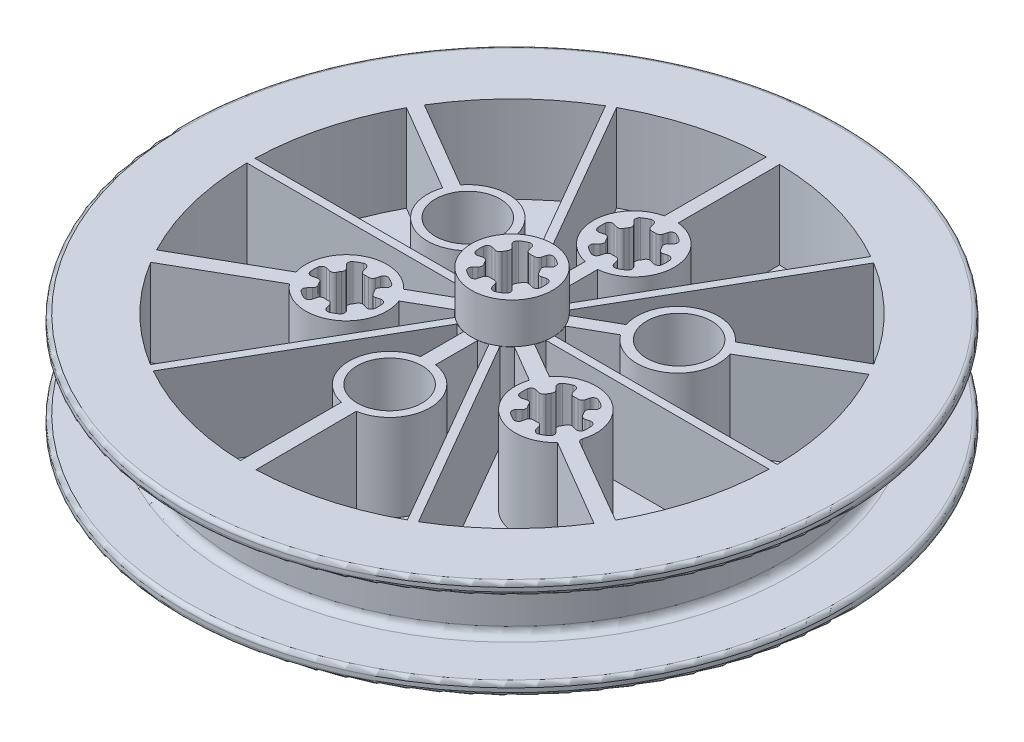
from build123d import *
from build123d.topology import SkipClean

# Parameters (mm, degrees)
SKETCH1_R            = 4
SKETCH1_R_2          = 4.000000000000001
SKETCH1_R_3          = 4.000000000002521
BOSS_EXTRUDE2_DEPTH  = 12.25
SKETCH5_R            = 5
BOSS_EXTRUDE20_DEPTH = 5
SKETCH1_25_R         = 33.5
SKETCH1_25_R_2       = 32.49999999999951
BOSS_EXTRUDE25_DEPTH = 1.9
SKETCH1_26_R         = 33.5
BOSS_EXTRUDE26_DEPTH = 12.25
SKETCH1_27_R         = 40.7
SKETCH1_27_R_2       = 33.5
BOSS_EXTRUDE27_DEPTH = 1.5
BOSS_EXTRUDE31_START = 0.5
SKETCH7_R            = 33
SKETCH7_R_2          = 32.5
BOSS_EXTRUDE31_DEPTH = 0.5
FILLET1_R            = 0.2
SKETCH8_R            = 40.700000000000486
SKETCH8_R_2          = 32.5
BOSS_EXTRUDE32_DEPTH = 1.5
BOSS_EXTRUDE34_DEPTH = 1.5
SKETCH12_R           = 4.999999999999999
SKETCH12_R_2         = 4.000000000002519
SKETCH12_R_3         = 4.999999999999998
SKETCH12_R_4         = 4.000000000000002
SKETCH12_R_5         = 5
SKETCH12_R_6         = 4.000000000000426
SKETCH12_R_7         = 4.000000000002514
SKETCH12_R_8         = 5.000000000000001
SKETCH12_R_9         = 3.999999999999999
SKETCH12_R_10        = 4.000000000002774
SKETCH12_R_11        = 4.000000000000001
CUT_EXTRUDE4_DEPTH   = 1
SKETCH13_R           = 33.5
SKETCH13_R_2         = 32.5
BOSS_EXTRUDE35_DEPTH = 1.5
FILLET3_R            = 1
FILLET4_R            = 0.5
CUT_EXTRUDE6_DEPTH   = 1


with BuildPart() as part:
    # Sketch1 → Boss-Extrude2 (new body)
    with BuildSketch(Plane(origin=(0, 0, 0), x_dir=(1, 0, 0), z_dir=(0, 1, 0))):
        with BuildLine():
            ThreePointArc((-2.2918818513503574, -4.47008824416207), (-1.6926719174056701, -4.729616592406967), (-1.0648594531500766, -4.909224549374468))
            Line((-1.0648594531500764, -4.909224549374468), (-1.0648594531500764, -10.231843746441845))
            ThreePointArc((-1.0648594531500764, -10.231843746441845), (-4.99999999999975, -15.117135380012597), (-1.0648594531500712, -20.002427013583347))
            Line((-1.0648594531500717, -20.002427013583347), (-1.0648594531500741, -32.48255030543379))
            ThreePointArc((-1.0648594531500857, -32.48255030543372), (-0.09221555466732205, -32.49986917345166), (0.8805109633733161, -32.488070124945494))
            Line((0.8805109633733107, -32.48807012494555), (0.8161170329181946, -20.050081050560667))
            ThreePointArc((0.8161170329181944, -20.050081050560664), (4.999843819107961, -15.077615960379166), (0.7380386407703021, -10.171905459702453))
            Line((0.7380386407703001, -10.171905459702453), (0.7380386407702995, -4.968874147719385))
            ThreePointArc((0.7380386407702995, -4.968874147719385), (1.2950188462934278, -4.853590167998218), (1.8353962845159248, -4.6760808173007735))
            Line((1.8353962845159248, -4.676080817300772), (15.5974341524379, -28.512629620229067))
            ThreePointArc((15.597434152437897, -28.512629620229067), (16.034231164378113, -28.269301918641105), (16.467233092019097, -28.019283258019133))
            Line((16.467233092019104, -28.01928325801913), (2.7252690509273503, -4.219872027822955))
            ThreePointArc((2.725269050927352, -4.219872027822955), (3.236142800542777, -3.842107638476601), (3.695245018561022, -3.402877544658933))
            Line((3.6952450185610215, -3.4028775446589337), (8.178197539841014, -6.033317294078193))
            ThreePointArc((8.178197539841014, -6.033317294078193), (10.419355986180925, -11.857863973664266), (16.597192365557596, -10.973289005711862))
            Line((16.597192365557596, -10.97328900571186), (27.47690424022315, -17.357123418746756))
            ThreePointArc((27.476904240223096, -17.357123418746742), (27.984074961970066, -16.52699453992879), (28.466173645599028, -15.68205847389299))
            Line((28.466173645599095, -15.682058473893013), (17.607344397490255, -9.385822261106501))
            ThreePointArc((17.607344397490255, -9.385822261106501), (15.464785327260277, -3.2079212319304897), (9.038754384521578, -4.417527291225647))
            Line((9.038754384521578, -4.417527291225647), (4.659098633614835, -1.8780871261452148))
            ThreePointArc((4.659098633614834, -1.8780871261452146), (4.8462222975544265, -1.322324004860492), (4.967302920189523, -0.7485406002480782))
            Line((4.967302920189525, -0.7485406002480784), (32.49137865603397, -0.7485406002483899))
            ThreePointArc((32.49137865603374, -0.7485406002483839), (32.49904919098418, -0.24859944081702565), (32.499027643285885, 0.2514005587186677))
            Line((32.499027643286134, 0.2514005587186691), (5.017150902277709, 0.2502162163391154))
            ThreePointArc((5.017150902277709, 0.25021621633911545), (4.89364948311526, 1.1342865896901178), (4.615620126980097, 1.9825393248458538))
            Line((4.615620126980097, 1.9825393248458536), (8.951224879514918, 4.445213354622798))
            ThreePointArc((8.951224879514918, 4.445213354622798), (15.391170968298637, 2.989534233878155), (17.77168358896793, 9.147867368083126))
            Line((17.771683588967928, 9.147867368083126), (28.529772011152474, 15.566056308251646))
            ThreePointArc((28.529772011152303, 15.566056308250966), (28.132781829949607, 16.272571600961715), (27.718298982971337, 16.968968781000736))
            Line((27.718298982971767, 16.968968781000996), (16.815115416008513, 10.775833441208782))
            ThreePointArc((16.815115416008513, 10.775833441208782), (10.519171918968485, 11.840408314550999), (8.209199311623989, 5.887572794213629))
            Line((8.20919931162399, 5.887572794213627), (3.742737954526289, 3.3505706879414396))
            ThreePointArc((3.7427379545262895, 3.35057068794144), (3.4494069084078975, 3.651849300200089), (3.131906635673611, 3.9275402170527522))
            Line((3.131906635673614, 3.9275402170527514), (16.893944503596078, 27.764089019980755))
            ThreePointArc((16.893944503595705, 27.764089019980137), (16.464818026605933, 28.020702477823516), (16.031794551266668, 28.270683816737233))
            Line((16.03179455126703, 28.270683816737876), (2.2918818513503574, 4.470088244162071))
            ThreePointArc((2.291881851350358, 4.470088244162071), (1.447599072859044, 4.810287751829694), (0.5557856856659524, 4.992545803771144))
            Line((0.5557856856659525, 4.992545803771144), (0.555785685665953, 10.020571371529982))
            ThreePointArc((0.5557856856659533, 10.020571371529982), (5.053047217068155, 14.994880206200344), (0.5557856856659524, 19.969189040870706))
            Line((0.5557856856664081, 19.969189040870706), (0.5557856856659525, 32.495247379757075))
            ThreePointArc((0.5557856856659381, 32.49524737975616), (-0.25461604252129455, 32.499002610400694), (-1.0648594531500417, 32.482550305432866))
            Line((-1.0648594531500741, 32.48255030543379), (-1.064859453150062, 19.8682143225614))
            ThreePointArc((-1.0648594531500624, 19.8682143225614), (-4.954259999183266, 14.98756901719496), (-1.06485945315007, 10.106923711828514))
            Line((-1.06485945315007, 10.106923711828514), (-1.0648594531500877, 10.098350378201738))
            Line((-1.0648594531500877, 10.098350378201738), (-1.0648594531500761, 4.909224549374469))
            ThreePointArc((-1.0648594531500761, 4.9092245493744695), (-1.4548057725749315, 4.808113090935642), (-1.8353962845158296, 4.676080817300809))
            Line((-1.835396284515829, 4.676080817300807), (-15.597434152437561, 28.512629620229255))
            ThreePointArc((-15.597434152437089, 28.51262962022839), (-16.03423116437732, 28.26930191864043), (-16.46723309201828, 28.019283258018476))
            Line((-16.467233092018773, 28.01928325801933), (-2.7252690509273556, 4.219872027822952))
            ThreePointArc((-2.7252690509273534, 4.219872027822953), (-3.42914574340126, 3.6708814747493683), (-4.024739482808163, 3.005974621760659))
            Line((-4.024739482808163, 3.00597462176066), (-8.501325300589102, 5.376343629180012))
            ThreePointArc((-8.501325300589102, 5.3763436291800115), (-10.380341895563507, 11.801314402528128), (-16.965625091455326, 10.599233692895234))
            Line((-16.965625091455326, 10.599233692895233), (-27.745486205260764, 16.924479171711145))
            ThreePointArc((-27.74548620525998, 16.92447917171067), (-28.15885130630869, 16.227417943380207), (-28.554707531857517, 15.520266678444038))
            Line((-28.554707531858316, 15.520266678444468), (-17.734483356240965, 9.171337566644638))
            ThreePointArc((-17.734483356240965, 9.171337566644636), (-15.637630039748842, 3.294795084113063), (-9.442690235507182, 4.038613745955226))
            Line((-9.442690235507182, 4.038613745955228), (-4.7730483101960495, 1.5660208043569244))
            ThreePointArc((-4.7730483101960495, 1.5660208043569244), (-4.8872977189696964, 1.1613493605705651), (-4.967302920189622, 0.7485406002480357))
            Line((-4.967302920189624, 0.7485406002480358), (-32.49137865603398, 0.7485406002482996))
            ThreePointArc((-32.49137865603322, 0.7485406002482854), (-32.49904919098368, 0.24859944081692759), (-32.49902764328539, -0.25140055871875133))
            Line((-32.499027643286134, -0.2514005587187593), (-5.017150902277709, -0.25021621633911756))
            ThreePointArc((-5.017150902277709, -0.25021621633911756), (-4.9454342192663425, -0.8815280563059746), (-4.794600908922696, -1.4987372869524944))
            Line((-4.794600908922696, -1.4987372869524946), (-9.314104815684146, -4.065868179630752))
            ThreePointArc((-9.314104815684146, -4.065868179630752), (-15.47888942890401, -3.0944949882740653), (-17.801743224793555, -8.886945717214312))
            Line((-17.801743224793555, -8.886945717214312), (-28.77016193736804, -15.117135380012291))
            ThreePointArc((-28.770161937367586, -15.117135380012042), (-28.304834600769677, -15.971422548509555), (-27.814147844823488, -16.81140028868117))
            Line((-27.8141478448239, -16.81140028868143), (-16.93203271226871, -10.555496410855127))
            ThreePointArc((-16.93203271226871, -10.555496410855127), (-10.510533943821489, -11.788936341515061), (-8.345068048373115, -5.619027269951237))
            Line((-8.345068048373115, -5.6190272699512365), (-3.956020478569378, -3.095854212375603))
            ThreePointArc((-3.956020478569378, -3.095854212375603), (-3.5682773290201832, -3.535789619638679), (-3.1319066356736642, -3.9275402170528193))
            Line((-3.131906635673664, -3.927540217052819), (-16.893944503596074, -27.76408901998076))
            ThreePointArc((-16.893944503595943, -27.76408901998053), (-16.464818026606185, -28.02070247782392), (-16.03179455126691, -28.27068381673766))
            Line((-16.031794551267026, -28.27068381673788), (-2.2918818513503574, -4.470088244162071))
        make_face()
        with Locations(Location((2.4937e-13, -15.117135380012597, 0), (0, 0, 270))):
            Circle(SKETCH1_R, mode=Mode.SUBTRACT)
        with BuildLine():
            ThreePointArc((-14.773731774722377, -9.215913114621364), (-15.171028331216945, -8.698146161654453), (-15.420779387478508, -8.095193774410388))
            Line((-15.420779387478508, -8.095193774410388), (-16.869668126914537, -8.483422342064834))
            ThreePointArc((-16.869668126914537, -8.483422342064834), (-17.00596482175836, -7.448146161653976), (-16.869668126914252, -6.412869981243155))
            Line((-16.869668126914252, -6.412869981243155), (-15.420779387478204, -6.801098548897544))
            ThreePointArc((-15.420779387478204, -6.801098548897544), (-15.171028331216563, -6.198146161653819), (-14.773731774721536, -5.680379208687615))
            Line((-14.773731774721536, -5.680379208687615), (-15.834391946503139, -4.619719036906016))
            ThreePointArc((-15.834391946503139, -4.619719036906016), (-15.005964821756415, -3.984044546514136), (-14.041241002165814, -3.5844428564956576))
            Line((-14.041241002165814, -3.5844428564956576), (-13.653012434511417, -5.0333315959317))
            ThreePointArc((-13.653012434511417, -5.033331595931699), (-13.005964821755521, -4.94814616165497), (-12.358917208999705, -5.033331595932305))
            Line((-12.358917208999705, -5.033331595932306), (-11.970688641345273, -3.584442856496271))
            ThreePointArc((-11.970688641345273, -3.5844428564962705), (-11.00596482175469, -3.9840445465150847), (-10.177537697007942, -4.61971903690712))
            Line((-10.177537697007942, -4.61971903690712), (-11.238197868789541, -5.680379208688722))
            ThreePointArc((-11.238197868789541, -5.680379208688722), (-10.840901312294687, -6.198146161654561), (-10.591150256033133, -6.8010985488978974))
            Line((-10.591150256033133, -6.8010985488978974), (-9.142261516597127, -6.41286998124337))
            ThreePointArc((-9.142261516597127, -6.41286998124337), (-9.005964821753324, -7.448146161653967), (-9.142261516596834, -8.483422342064603))
            Line((-9.142261516596834, -8.483422342064603), (-10.59115025603286, -8.09519377441015))
            ThreePointArc((-10.59115025603286, -8.09519377441015), (-10.840901312294369, -8.69814616165382), (-11.238197868788799, -9.215913114620355))
            Line((-11.238197868788799, -9.215913114620355), (-10.177537697007196, -10.276573286401954))
            ThreePointArc((-10.177537697007196, -10.276573286401955), (-11.005964821753924, -10.912247776794022), (-11.970688641344408, -11.311849466813083))
            Line((-11.970688641344408, -11.311849466813083), (-12.358917208998811, -9.862960727377041))
            ThreePointArc((-12.358917208998811, -9.862960727377041), (-13.005964821755542, -9.948146161654972), (-13.653012434512354, -9.862960727377637))
            Line((-13.653012434512354, -9.862960727377637), (-14.041241002166764, -11.311849466813674))
            ThreePointArc((-14.041241002166764, -11.311849466813674), (-15.005964821757274, -10.912247776794914), (-15.83439194650398, -10.276573286402963))
            Line((-15.83439194650398, -10.276573286402963), (-14.773731774722377, -9.215913114621364))
        make_face(mode=Mode.SUBTRACT)
        with BuildLine():
            ThreePointArc((15.368080763693458, -8.18647046829626), (15.118329707431727, -8.789422855540518), (14.721033150936481, -9.30718980850722))
            Line((14.721033150936481, -9.30718980850722), (15.781693322718091, -10.367849980288812))
            ThreePointArc((15.781693322718091, -10.367849980288812), (14.953266197971104, -11.003524470680494), (13.988542378380423, -11.403126160699015))
            Line((13.988542378380423, -11.403126160699015), (13.600313810725943, -9.954237421262992))
            ThreePointArc((13.600313810725943, -9.954237421262992), (12.953266197969558, -10.039422855539994), (12.306218585213259, -9.954237421262341))
            Line((12.306218585213259, -9.954237421262341), (11.917990017558822, -11.40312616069837))
            ThreePointArc((11.917990017558822, -11.40312616069837), (10.953266197968532, -11.003524470679336), (10.124839073222082, -10.367849980287215))
            Line((10.124839073222082, -10.367849980287215), (11.185499245003712, -9.307189808505642))
            ThreePointArc((11.185499245003712, -9.307189808505642), (10.788202688509426, -8.789422855539545), (10.538451632248101, -8.18647046829627))
            Line((10.538451632248101, -8.18647046829627), (9.089562892812067, -8.574699035950701))
            ThreePointArc((9.089562892812067, -8.574699035950701), (8.953266197968262, -7.539422855539893), (9.089562892812118, -6.504146675129093))
            Line((9.089562892812118, -6.504146675129093), (10.53845163224815, -6.892375242783522))
            ThreePointArc((10.53845163224815, -6.892375242783522), (10.788202688509596, -6.289422855540408), (11.185499245003825, -5.771655902574399))
            Line((11.185499245003825, -5.771655902574399), (10.124839073222152, -4.710995730792868))
            ThreePointArc((10.124839073222152, -4.710995730792868), (10.953266197968578, -4.07532124040063), (11.917990017558935, -3.6757195503816114))
            Line((11.917990017558935, -3.6757195503816114), (12.306218585213347, -5.124608289817649))
            ThreePointArc((12.306218585213347, -5.124608289817649), (12.95326619796956, -5.039422855539993), (13.600313810725858, -5.124608289816997))
            Line((13.600313810725858, -5.124608289816997), (13.988542378380286, -3.6757195503809625))
            ThreePointArc((13.988542378380286, -3.675719550380962), (14.953266197971073, -4.075321240399481), (15.78169332271807, -4.7109957307913195))
            Line((15.78169332271807, -4.7109957307913195), (14.721033150936453, -5.7716559025729))
            ThreePointArc((14.721033150936453, -5.7716559025729), (15.11832970743163, -6.289422855539564), (15.368080763693454, -6.892375242783708))
            Line((15.368080763693454, -6.892375242783708), (16.81696950312949, -6.504146675129255))
            ThreePointArc((16.81696950312949, -6.504146675129254), (16.953266197973296, -7.539422855539974), (16.816969503129492, -8.574699035950694))
            Line((16.816969503129492, -8.574699035950694), (15.368080763693458, -8.18647046829626))
        make_face(mode=Mode.SUBTRACT)
        with Locations(Location((-13.00596482175603, 7.546187583095501, 0), (0, 0, 270))):
            Circle(SKETCH1_R_2, mode=Mode.SUBTRACT)
        with BuildLine():
            Line((-1.035276180409333, 3.863703305156718), (-0.647047612755795, 2.414814565722806))
            ThreePointArc((-0.6470476127557949, 2.414814565722806), (2.7273e-13, 2.4999999999999996), (0.647047612756322, 2.414814565722665))
            Line((0.647047612756322, 2.414814565722665), (1.0352761804103423, 3.863703305157112))
            ThreePointArc((1.0352761804103428, 3.863703305157112), (2.0000000000003046, 3.4641016151382225), (2.8284271247466313, 2.828427124746537))
            Line((2.828427124746631, 2.828427124746537), (1.7677669529664157, 1.7677669529663218))
            ThreePointArc((1.7677669529664155, 1.7677669529663214), (2.1650635094611403, 1.2499999999999236), (2.414814565722699, 0.6470476127561955))
            Line((2.414814565722699, 0.6470476127561955), (3.863703305157166, 1.03527618041014))
            ThreePointArc((3.8637033051577623, 1.0352761804103), (4.000000000002368, -3.3951e-13), (3.8637033051595298, -1.0352761804112112))
            Line((3.8637033051570566, -1.0352761804105486), (2.4148145657226303, -0.647047612756451))
            ThreePointArc((2.4148145657226308, -0.6470476127564506), (2.165063509461008, -1.2500000000001525), (1.767766952966228, -1.767766952966509))
            Line((1.7677669529662279, -1.767766952966509), (2.8284271247464434, -2.8284271247467245))
            ThreePointArc((2.828427124750198, -2.828427124750479), (2.0000000000031344, -3.464101615144097), (1.0352761804117845, -3.8637033051642344))
            Line((1.0352761804099078, -3.863703305157229), (0.6470476127560503, -2.414814565722738))
            ThreePointArc((0.6470476127560504, -2.4148145657227373), (-2.6468e-13, -2.499999999999999), (-0.6470476127565618, -2.4148145657226006))
            Line((-0.6470476127565618, -2.4148145657226006), (-1.0352761804105601, -3.86370330515639))
            ThreePointArc((-1.035276180416107, -3.863703305164621), (-2.000000000006813, -3.4641016151453012), (-2.8284271247536132, -2.828427124752828))
            Line((-2.828427124747038, -2.82842712474625), (-1.7677669529666145, -1.7677669529661222))
            ThreePointArc((-1.7677669529666145, -1.7677669529661224), (-2.1650635094612727, -1.2499999999996947), (-2.4148145657227627, -0.6470476127559568))
            Line((-2.4148145657227627, -0.6470476127559568), (-3.86370330515727, -1.0352761804097583))
            ThreePointArc((-3.863703305165119, -1.0352761804118635), (-4.000000000008132, 5.0815e-13), (-3.8637033051629137, 1.0352761804125863))
            Line((-3.8637033051569403, 1.035276180410985), (-2.4148145657225575, 0.6470476127567235))
            ThreePointArc((-2.4148145657225575, 0.6470476127567237), (-2.165063509460876, 1.250000000000382), (-1.7677669529660534, 1.7677669529666837))
            Line((-1.7677669529660534, 1.7677669529666837), (-2.8284271247461406, 2.828427124747149))
            ThreePointArc((-2.8284271247489645, 2.828427124749968), (-2.0000000000011804, 3.464101615141045), (-1.0352761804098867, 3.8637033051587784))
        make_face(mode=Mode.SUBTRACT)
        with Locations(Location((13.093722927441931, 7.546187583095501, 0), (0, 0, 270))):
            Circle(SKETCH1_R_3, mode=Mode.SUBTRACT)
        with BuildLine():
            Line((-0.9825775566255038, 18.851272322353655), (-0.5943489889710725, 17.402383582917622))
            ThreePointArc((-0.5943489889710725, 17.402383582917622), (0.05269862378576343, 17.48756901719508), (0.6997462365425813, 17.402383582917484))
            Line((0.6997462365425811, 17.402383582917484), (1.0879748041970003, 18.851272322353513))
            ThreePointArc((1.087974804197, 18.851272322353513), (2.052698623787637, 18.45167063233469), (2.8811257485342745, 17.815996141942428))
            Line((2.881125748534274, 17.815996141942428), (1.8204655767527047, 16.755335970160797))
            ThreePointArc((1.8204655767527043, 16.755335970160797), (2.217762133247356, 16.237569017194318), (2.467513189508705, 15.63461662995048))
            Line((2.467513189508704, 15.63461662995048), (3.916401928944737, 16.022845197604916))
            ThreePointArc((3.9164019289447363, 16.022845197604916), (4.052698623788039, 14.98756901719399), (3.9164019289439533, 13.95229283678317))
            Line((3.916401928943954, 13.95229283678317), (2.46751318950793, 14.34052140443764))
            ThreePointArc((2.4675131895079296, 14.34052140443764), (2.2177621332461133, 13.737569017194536), (1.8204655767516114, 13.21980206422857))
            Line((1.8204655767516114, 13.21980206422857), (2.8811257485332122, 12.15914189244697))
            ThreePointArc((2.8811257485332122, 12.15914189244697), (2.0526986237864335, 11.523467402054976), (1.08797480419583, 11.123865712036212))
            Line((1.0879748041958297, 11.123865712036212), (0.6997462365413962, 12.57275445147224))
            ThreePointArc((0.6997462365413968, 12.57275445147224), (0.05269862378563325, 12.487569017195078), (-0.5943489889701395, 12.57275445147217))
            Line((-0.5943489889701394, 12.57275445147217), (-0.9825775566244758, 11.123865712036109))
            ThreePointArc((-0.9825775566244757, 11.123865712036107), (-1.9473013762148768, 11.523467402054816), (-2.7757285009616544, 12.159141892446472))
            Line((-2.7757285009616535, 12.159141892446472), (-1.7150683291800386, 13.219802064228059))
            ThreePointArc((-1.7150683291800384, 13.219802064228059), (-2.11236488567484, 13.737569017194318), (-2.36211594193664, 14.340521404437878))
            Line((-2.3621159419366395, 14.340521404437878), (-3.8110046813726735, 13.952292836783444))
            ThreePointArc((-3.8110046813726735, 13.952292836783444), (-3.9473013762169966, 14.987569017194023), (-3.811004681373439, 16.022845197604703))
            Line((-3.8110046813734395, 16.022845197604703), (-2.3621159419374145, 15.634616629950246))
            ThreePointArc((-2.362115941937415, 15.634616629950246), (-2.11236488567607, 16.23756901719456), (-1.7150683291810938, 16.755335970161344))
            Line((-1.715068329181094, 16.755335970161344), (-2.7757285009627095, 17.81599614194293))
            ThreePointArc((-2.77572850096271, 17.81599614194293), (-1.9473013762160112, 18.451670632334885), (-0.9825775566255038, 18.851272322353655))
        make_face(mode=Mode.SUBTRACT)
    extrude(amount=BOSS_EXTRUDE2_DEPTH)

    # Sketch5 → Boss-Extrude20 (add)
    with BuildSketch(Plane(origin=(0, 12.25, 0), x_dir=(1, 0, 0), z_dir=(0, 1, 0))):
        with Locations(Location((0, 0, 0), (0, 0, 270))):
            Circle(SKETCH5_R)
        with BuildLine():
            Line((0.647047612756322, 2.414814565722665), (1.0352761804102257, 3.8637033051566765))
            ThreePointArc((1.0352761804102257, 3.8637033051566765), (2.0000000000001767, 3.4641016151379604), (2.828427124746425, 2.8284271247463315))
            Line((2.828427124746425, 2.8284271247463315), (1.7677669529658406, 1.7677669529663331))
            ThreePointArc((1.7677669529658406, 1.7677669529663331), (2.165063509461037, 1.250000000000103), (2.414814565722699, 0.6470476127561954))
            Line((2.414814565722699, 0.6470476127561954), (3.8637033051567893, 1.035276180410039))
            ThreePointArc((3.8637033051567893, 1.035276180410039), (4.000000000000164, -2.1161e-13), (3.8637033051563683, -1.0352761804103643))
            Line((3.8637033051563683, -1.0352761804103643), (2.41481456572263, -0.6470476127564508))
            ThreePointArc((2.41481456572263, -0.6470476127564508), (2.1650635094612833, -1.2499999999999396), (1.7677669529667768, -1.7677669529661466))
            Line((1.7677669529667768, -1.7677669529661466), (2.8284271247464408, -2.828427124746722))
            ThreePointArc((2.8284271247464408, -2.828427124746722), (2.0000000000001426, -3.464101615138617), (1.0352761804098922, -3.8637033051571708))
            Line((1.0352761804098922, -3.8637033051571708), (0.6470476127560505, -2.4148145657227382))
            ThreePointArc((0.6470476127560505, -2.4148145657227382), (-2.645e-13, -2.499999999999975), (-0.6470476127565616, -2.4148145657226))
            Line((-0.6470476127565616, -2.4148145657226), (-1.035276180410643, -3.8637033051567005))
            ThreePointArc((-1.035276180410643, -3.8637033051567005), (-2.0000000000004894, -3.464101615138238), (-2.8284271247466126, -2.8284271247467063))
            Line((-2.8284271247466126, -2.8284271247467063), (-1.7677669529666147, -1.7677669529661222))
            ThreePointArc((-1.7677669529666147, -1.7677669529661222), (-2.165063509461272, -1.2499999999996947), (-2.414814565722762, -0.6470476127559568))
            Line((-2.414814565722762, -0.6470476127559568), (-3.8637033051572103, -1.0352761804097426))
            ThreePointArc((-3.8637033051572103, -1.0352761804097426), (-4.000000000000711, 6.3643e-13), (-3.8637033051567795, 1.0352761804109418))
            Line((-3.8637033051567795, 1.0352761804109418), (-2.414814565722557, 0.6470476127567234))
            ThreePointArc((-2.414814565722557, 0.6470476127567234), (-2.1650635094608766, 1.2500000000003817), (-1.7677669529660538, 1.767766952966684))
            Line((-1.7677669529660538, 1.767766952966684), (-2.8284271247460206, 2.828427124747029))
            ThreePointArc((-2.8284271247460206, 2.828427124747029), (-1.9999999999994107, 3.464101615138284), (-1.035276180409315, 3.8637033051566494))
            Line((-1.035276180409315, 3.8637033051566494), (-0.6470476127557949, 2.414814565722806))
            ThreePointArc((-0.6470476127557949, 2.414814565722806), (2.7327e-13, 2.4999999999999996), (0.647047612756322, 2.414814565722665))
        make_face(mode=Mode.SUBTRACT)
    extrude(amount=BOSS_EXTRUDE20_DEPTH)

    # Sketch1<25> → Boss-Extrude25 (add)
    with BuildSketch(Plane(origin=(0, 0, 0), x_dir=(1, 0, 0), z_dir=(0, 1, 0))):
        with Locations(Location((2.4937e-13, -4.2414e-13, 0), (0, 0, 90))):
            Circle(SKETCH1_25_R)
        Circle(SKETCH1_25_R_2, mode=Mode.SUBTRACT)
    extrude(amount=BOSS_EXTRUDE25_DEPTH)

    # Sketch1<26> → Boss-Extrude26 (add)
    with BuildSketch(Plane(origin=(0, 0, 0), x_dir=(1, 0, 0), z_dir=(0, 1, 0))):
        with Locations(Location((2.4937e-13, -4.2414e-13, 0), (0, 0, 90))):
            Circle(SKETCH1_26_R)
        with BuildLine():
            ThreePointArc((-1.0648594531500755, -32.48255030543379), (-8.803911026716351, -31.28483899005495), (-16.031794551267026, -28.27068381673788))
            ThreePointArc((-16.03179455126691, -28.27068381673766), (-16.464818026606185, -28.02070247782392), (-16.893944503595943, -27.76408901998053))
            ThreePointArc((-16.893944503596074, -27.76408901998076), (-23.015076101761966, -22.946813984300853), (-27.8141478448239, -16.811400288681426))
            ThreePointArc((-27.814147844823488, -16.81140028868117), (-28.304834600769677, -15.971422548509555), (-28.770161937367586, -15.117135380012042))
            ThreePointArc((-28.77016193736804, -15.117135380012291), (-31.52341853149482, -7.907217215190817), (-32.49902764328613, -0.25140055871875927))
            ThreePointArc((-32.49902764328539, -0.25140055871875133), (-32.49904919098368, 0.24859944081692759), (-32.49137865603322, 0.7485406002482854))
            ThreePointArc((-32.49137865603397, 0.7485406002482997), (-31.40393498508122, 8.36916169355039), (-28.554707531858316, 15.520266678444468))
            ThreePointArc((-28.554707531857517, 15.520266678444038), (-28.15885130630869, 16.227417943380207), (-27.74548620525998, 16.92447917171067))
            ThreePointArc((-27.745486205260768, 16.92447917171115), (-22.791770583774365, 23.16862519996828), (-16.467233092018773, 28.019283258019335))
            ThreePointArc((-16.46723309201828, 28.019283258018476), (-16.03423116437732, 28.26930191864043), (-15.597434152437089, 28.51262962022839))
            ThreePointArc((-15.597434152437563, 28.51262962022926), (-8.564349047733016, 31.351266727017506), (-1.0648594531500744, 32.48255030543379))
            ThreePointArc((-1.0648594531500417, 32.482550305432866), (-0.25461604252129455, 32.499002610400694), (0.5557856856659381, 32.49524737975616))
            ThreePointArc((0.5557856856659525, 32.495247379757075), (8.558544785982592, 31.352851722711456), (16.031794551267033, 28.27068381673788))
            ThreePointArc((16.031794551266668, 28.270683816737233), (16.464818026605933, 28.020702477823516), (16.893944503595705, 27.764089019980137))
            ThreePointArc((16.893944503596078, 27.764089019980762), (22.94987412753524, 23.012024629099646), (27.71829898297177, 16.968968781001))
            ThreePointArc((27.718298982971337, 16.968968781000736), (28.132781829949607, 16.272571600961715), (28.529772011152303, 15.566056308250966))
            ThreePointArc((28.529772011152474, 15.566056308251646), (31.460503285819776, 8.153939722791847), (32.499027643286134, 0.25140055871866984))
            ThreePointArc((32.499027643285885, 0.25140055871866757), (32.49975690991217, 0.12570121956590555), (32.49999999999976, -4.2414e-13))
            ThreePointArc((32.49999999999976, -4.321e-13), (32.49784459253469, -0.37429512346297844), (32.49137865603374, -0.7485406002484017))
            ThreePointArc((32.49137865603397, -0.7485406002483885), (31.380061897201514, -8.458233582007626), (28.466173645599092, -15.682058473893013))
            ThreePointArc((28.466173645599028, -15.68205847389299), (27.984074961970066, -16.52699453992879), (27.476904240223096, -17.357123418746742))
            ThreePointArc((27.47690424022315, -17.35712341874676), (27.45968172188409, -17.38435732872588), (27.442432210489656, -17.411574149762576))
            ThreePointArc((27.442432210489656, -17.411574149762576), (22.586401879802203, -23.36887781054254), (16.467233092019107, -28.019283258019133))
            ThreePointArc((16.467233092019097, -28.019283258019133), (16.034231164378113, -28.269301918641105), (15.597434152437897, -28.512629620229067))
            ThreePointArc((15.597434152437902, -28.512629620229067), (8.475358435579984, -31.375441023011035), (0.8805109633733107, -32.48807012494555))
            ThreePointArc((0.8805109633733161, -32.488070124945494), (-0.09221555466732205, -32.49986917345166), (-1.0648594531500857, -32.48255030543372))
        make_face(mode=Mode.SUBTRACT)
    extrude(amount=BOSS_EXTRUDE26_DEPTH)

    # Sketch1<27> → Boss-Extrude27 (add)
    with BuildSketch(Plane(origin=(0, 0, 0), x_dir=(1, 0, 0), z_dir=(0, 1, 0))):
        with Locations(Location((2.4937e-13, -4.2414e-13, 0), (0, 0, 270))):
            Circle(SKETCH1_27_R)
        with Locations(Location((2.4937e-13, -4.2414e-13, 0), (0, 0, 90))):
            Circle(SKETCH1_27_R_2, mode=Mode.SUBTRACT)
    extrude(amount=BOSS_EXTRUDE27_DEPTH)

    # Sketch7 → Boss-Extrude31 (add)
    with SkipClean():  # the faces are left unmerged after this step: merging them gives an invalid solid
        with BuildSketch(Plane.XZ.offset(BOSS_EXTRUDE31_START)):
            with Locations(Location((0, 0, 0), (0, 0, 90))):
                Circle(SKETCH7_R)
            with Locations(Location((0, 0, 0), (0, 0, 270))):
                Circle(SKETCH7_R_2, mode=Mode.SUBTRACT)
        extrude(amount=-BOSS_EXTRUDE31_DEPTH)

    # Fillet1
    fillet1_edges = [part.edges().sort_by_distance(p)[0] for p in [
        (-6.06e-15, -0.5, -33),
        (9.95e-15, -0.5, 32.5),
    ]]
    fillet(fillet1_edges, radius=FILLET1_R)

    # Sketch11 → Boss-Extrude34 (add)
    with BuildSketch(Plane.XZ):
        with BuildLine():
            ThreePointArc((-1.0648594532635174, 32.482550308894254), (-8.803911027137463, 31.284838992100713), (-16.03179455176526, 28.27068381761647))
            Line((-16.03179455126703, 28.270683816737886), (-2.2918818513503574, 4.470088244162071))
            ThreePointArc((-2.291881851350359, 4.470088244162072), (-1.6926719174056404, 4.729616592406883), (-1.0648594531500764, 4.909224549374468))
            Line((-1.0648594531500764, 4.909224549374468), (-1.0648594531500764, 10.231843746441845))
            ThreePointArc((-1.0648594531500768, 10.231843746441843), (-4.99999999999965, 15.117135380012549), (-1.0648594531500715, 20.002427013583247))
            Line((-1.0648594531500712, 20.002427013583247), (-1.0648594531500737, 32.48255030543379))
        make_face()
        with BuildLine():
            Line((-3.131906635673662, 3.927540217052819), (-16.893944503596074, 27.76408901998076))
            ThreePointArc((-16.8939445040632, 27.764089020748457), (-23.015076101897957, 22.94681398451292), (-27.81414784482506, 16.811400288682137))
            Line((-27.814147844823896, 16.811400288681426), (-16.932032712268747, 10.555496410855143))
            ThreePointArc((-16.932032712268747, 10.555496410855143), (-10.51053394382146, 11.78893634151509), (-8.345068048373065, 5.619027269951207))
            Line((-8.345068048373067, 5.619027269951206), (-3.956020478569378, 3.0958542123756025))
            ThreePointArc((-3.9560204785693767, 3.0958542123756017), (-3.5682773290201713, 3.535789619638668), (-3.1319066356736602, 3.927540217052818))
        make_face()
        with BuildLine():
            ThreePointArc((15.597434155880226, 28.512629626521605), (8.475358437193657, 31.375441028225328), (0.8805109634774144, 32.488070128786546))
            Line((0.8805109633733107, 32.48807012494555), (0.8161170329181946, 20.050081050560664))
            ThreePointArc((0.8161170329181947, 20.050081050560664), (4.9998438191082215, 15.077615960379163), (0.7380386407703002, 10.171905459702451))
            Line((0.7380386407703001, 10.171905459702453), (0.7380386407702995, 4.968874147719385))
            ThreePointArc((0.7380386407702993, 4.968874147719385), (1.2950188462934609, 4.85359016799829), (1.8353962845160199, 4.676080817300978))
            Line((1.8353962845159693, 4.67608081730085), (15.597434152437964, 28.51262962022903))
        make_face()
        with BuildLine():
            Line((-17.801743224793665, 8.886945717214077), (-28.770161937368044, 15.117135380012291))
            ThreePointArc((-28.770161937373405, 15.117135380015105), (-31.52341853178357, 7.907217215204375), (-32.49902764424519, 0.2514005587259241))
            Line((-32.499027643285785, 0.2514005587184896), (-5.017150902277706, 0.2502162163391733))
            ThreePointArc((-5.017150902277704, 0.25021621633917307), (-4.945434219266195, 0.8815280563059773), (-4.794600908922696, 1.4987372869524949))
            Line((-4.794600908922696, 1.498737286952495), (-9.314104815684104, 4.065868179630745))
            ThreePointArc((-9.314104815684104, 4.065868179630744), (-15.478889428903907, 3.094494988273965), (-17.801743224793665, 8.886945717214077))
        make_face()
        with BuildLine():
            ThreePointArc((27.476904249320285, 17.3571234244934), (22.60956025383998, 23.34647266122673), (16.46723309576794, 28.019283264397682))
            Line((16.467233092019175, 28.019283258019097), (2.725269050927361, 4.219872027822952))
            ThreePointArc((2.7252690509273796, 4.219872027822978), (3.2361428005427717, 3.8421076384765875), (3.695245018561023, 3.4028775446589345))
            Line((3.6952450185610224, 3.4028775446589337), (8.178197539841053, 6.033317294078206))
            ThreePointArc((8.178197539841051, 6.033317294078206), (10.419355986180914, 11.857863973664212), (16.5971923655575, 10.97328900571177))
            Line((16.5971923655575, 10.973289005711772), (27.476904240223153, 17.35712341874676))
        make_face()
        with BuildLine():
            Line((-4.967302920189628, -0.7485406002479779), (-32.491378656033625, -0.7485406002485712))
            ThreePointArc((-32.49137865710746, -0.748540600273302), (-31.403934987120433, -8.369161694244724), (-28.554707534947788, -15.520266680123678))
            Line((-28.55470753185832, -15.520266678444468), (-17.734483356241203, -9.171337566644933))
            ThreePointArc((-17.734483356241203, -9.171337566644931), (-15.637630039749068, -3.2947950841131357), (-9.442690235507182, -4.038613745955227))
            Line((-9.442690235507182, -4.038613745955227), (-4.773048310196051, -1.5660208043569248))
            ThreePointArc((-4.773048310196051, -1.566020804356925), (-4.8872977189696645, -1.1613493605705276), (-4.9673029201896295, -0.748540600247978))
        make_face()
        with BuildLine():
            ThreePointArc((32.491378669651944, 0.748540600562475), (31.380061909339958, 8.458233585124722), (28.46617365535941, 15.682058479269987))
            Line((28.466173645599095, 15.682058473893013), (17.607344397490255, 9.385822261106501))
            ThreePointArc((17.60734439749026, 9.385822261106501), (15.464785327260278, 3.207921231930489), (9.03875438452158, 4.417527291225648))
            Line((9.038754384521578, 4.417527291225647), (4.659098633614835, 1.878087126145215))
            ThreePointArc((4.659098633614835, 1.8780871261452152), (4.846222297553806, 1.322324004860573), (4.96730292018892, 0.7485406002484444))
            Line((4.967302920188921, 0.7485406002484444), (32.49137865603328, 0.7485406002487263))
        make_face()
        with BuildLine():
            Line((-16.96562509145561, -10.59923369289521), (-27.745486205260768, -16.92447917171115))
            ThreePointArc((-27.74548620853358, -16.924479173707528), (-22.79177058747594, -23.16862520405585), (-16.467233095692052, -28.0192832643241))
            Line((-16.46723309384331, -28.01928326117843), (-2.7252690509270963, -4.219872027822241))
            ThreePointArc((-2.7252690509269692, -4.219872027822289), (-3.4291457434011736, -3.6708814747491987), (-4.024739482808163, -3.00597462176066))
            Line((-4.024739482808163, -3.00597462176066), (-8.5013253005891, -5.3763436291800115))
            ThreePointArc((-8.5013253005891, -5.3763436291800115), (-8.454205714952487, -5.477011652045913), (-8.409335482342515, -5.578702204231566))
            ThreePointArc((-8.409335482342513, -5.578702204231566), (-10.475576214030163, -11.858626973265713), (-16.96562509145561, -10.59923369289521))
        make_face()
        with BuildLine():
            ThreePointArc((28.52977202405064, -15.566056315288991), (31.460503299771133, -8.153939726468655), (32.499027657022005, -0.25140055882459106))
            Line((32.49902764328544, -0.25140055871833444), (5.0171509022770095, -0.2502162163387059))
            ThreePointArc((5.0171509022770095, -0.25021621633870583), (4.8936494831152455, -1.1342865896899552), (4.615620126980097, -1.9825393248458536))
            Line((4.615620126980097, -1.9825393248458536), (9.16967400610493, -4.569295004497591))
            ThreePointArc((9.16967400610493, -4.569295004497591), (15.526390207041604, -3.2634105321246576), (17.660223691866534, -9.392026181149763))
            Line((17.66022369186653, -9.392026181149765), (28.529772011152478, -15.566056308251648))
        make_face()
        with BuildLine():
            Line((-1.8353962797319892, -4.676080818357329), (-15.597434152437883, -28.512629620228267))
            ThreePointArc((-15.597434156048578, -28.512629626828737), (-8.564349049976553, -31.351266735963005), (-1.0648594535044833, -32.48255031624425))
            Line((-1.0648594531500741, -32.48255030543379), (-1.064859453150075, -19.853136046609784))
            ThreePointArc((-1.064859453150075, -19.853136046609784), (-4.9395632456534875, -14.987569017194954), (-1.0648594531500695, -10.122001987780129))
            Line((-1.0648594531500697, -10.122001987780129), (-1.064859453150076, -4.909224549374469))
            ThreePointArc((-1.064859453150076, -4.909224549374469), (-1.454805768914586, -4.808113091449965), (-1.835396277340007, -4.6760808188859695))
        make_face()
        with BuildLine():
            ThreePointArc((16.89394451076782, -27.764089031767007), (22.949874137772696, -23.012024639289113), (27.718298995503073, -16.968968788672573))
            Line((27.718298982971767, -16.968968781000996), (16.81337589843636, -10.774845374954177))
            ThreePointArc((16.81337589843636, -10.774845374954177), (10.661055647842376, -11.828964634066413), (8.415656465898731, -6.004842864045896))
            Line((8.415656465898733, -6.004842864045897), (3.742737954526289, -3.35057068794144))
            ThreePointArc((3.7427379545262895, -3.3505706879414405), (3.4494069084073313, -3.651849300199363), (3.1319066356731966, -3.927540217052007))
            Line((3.1319066356731966, -3.9275402170520053), (16.893944503595613, -27.764089019979945))
        make_face()
        with BuildLine():
            Line((0.5557856856659525, -19.95441731175966), (0.5557856856659525, -32.495247379757075))
            ThreePointArc((0.5557856858563449, -32.495247390890306), (8.558544789447389, -31.35285173479733), (16.03179455801779, -28.270683828642323))
            Line((16.031794551266568, -28.270683816737073), (2.2918818513498938, -4.470088244161261))
            ThreePointArc((2.2918818513498938, -4.47008824416126), (1.4475990728589432, -4.810287751829583), (0.5557856856659527, -4.992545803771144))
            Line((0.5557856856659525, -4.992545803771144), (0.5557856856659525, -10.020720722630255))
            ThreePointArc((0.5557856856659522, -10.020720722630255), (5.044960493224004, -14.987569017194957), (0.5557856856659524, -19.95441731175966))
        make_face()
    extrude(amount=-BOSS_EXTRUDE34_DEPTH)

    # Sketch12 → Cut-Extrude4 (cut)
    # profile 1 of 31: a face of its own
    with BuildSketch(Plane.XZ):
        with Locations(Location((-13.00596482175603, 7.44814616165497, 0), (0, 0, 270))):
            Circle(SKETCH12_R)
        with Locations((-13.00596482175603, 7.44814616165497)):
            Circle(SKETCH12_R_2, mode=Mode.SUBTRACT)
    # profile 2 of 31: a face of its own
    with BuildSketch(Plane.XZ):
        with BuildLine():
            ThreePointArc((-11.970688641345532, 11.31184946681374), (-13.00596482175681, 11.448146161657489), (-14.041241002168034, 11.311849466813337))
            Line((-14.04124100216808, 11.31184946681351), (-13.653012434513666, 9.862960727377468))
            ThreePointArc((-13.653012434513666, 9.86296072737747), (-13.005964821757065, 9.948146161654169), (-12.358917209000523, 9.862960727377024))
            Line((-12.358917209000523, 9.862960727377024), (-11.970688641345996, 11.31184946681201))
        make_face()
    # profile 3 of 31: a face of its own
    with BuildSketch(Plane.XZ):
        with BuildLine():
            ThreePointArc((-15.83439194650472, 10.276573286402222), (-16.470066436896612, 9.44814616165511), (-16.869668126915144, 8.483422342064191))
            Line((-16.869668126916455, 8.483422342064541), (-15.420779387480424, 8.095193774410095))
            ThreePointArc((-15.420779387480426, 8.095193774410095), (-15.171028331216364, 8.69814616165288), (-14.773731774721808, 9.215913114619518))
            Line((-14.773731774721808, 9.215913114619518), (-15.83439194650529, 10.276573286402792))
        make_face()
    # profile 4 of 31: a face of its own
    with BuildSketch(Plane.XZ):
        with BuildLine():
            ThreePointArc((-16.86966812691449, 6.412869981243307), (-16.470066436895614, 5.448146161653096), (-15.834391946503679, 4.619719036906675))
            Line((-15.834391946504416, 4.619719036905935), (-14.773731774722744, 5.680379208687599))
            ThreePointArc((-14.773731774722744, 5.680379208687599), (-15.17102833121601, 6.198146161654638), (-15.42077938747767, 6.801098548897913))
            Line((-15.42077938747767, 6.801098548897913), (-16.869668126915776, 6.41286998124296))
        make_face()
    # profile 5 of 31: a face of its own
    with BuildSketch(Plane.XZ):
        with BuildLine():
            Line((-13.65301243451267, 5.033331595931885), (-14.041241002167064, 3.5844428564958424))
            ThreePointArc((-14.04124100216694, 3.5844428564963104), (-13.005964821756763, 3.448146161652451), (-11.970688641346536, 3.584442856495931))
            Line((-11.97068864134658, 3.5844428564961017), (-12.358917209001016, 5.033331595932137))
            ThreePointArc((-12.358917209001016, 5.033331595932136), (-13.005964821756827, 4.948146161654482), (-13.65301243451267, 5.033331595931884))
        make_face()
    # profile 6 of 31: a face of its own
    with BuildSketch(Plane.XZ):
        with BuildLine():
            Line((-11.238197868790847, 5.680379208688552), (-10.177537697009251, 4.619719036906951))
            ThreePointArc((-10.177537697008681, 4.619719036906377), (-9.541863206616705, 5.448146161652653), (-9.14226151659773, 6.412869981242725))
            Line((-9.14226151659904, 6.412869981243076), (-10.591150256035052, 6.801098548897607))
            ThreePointArc((-10.591150256035052, 6.801098548897607), (-10.840901312296232, 6.1981461616543285), (-11.238197868790847, 5.680379208688552))
        make_face()
    # profile 7 of 31: a face of its own
    with BuildSketch(Plane.XZ):
        with BuildLine():
            ThreePointArc((-9.142261516597072, 8.483422342064763), (-9.541863206615737, 9.448146161655608), (-10.177537697007734, 10.276573286402616))
            Line((-10.177537697008477, 10.276573286401874), (-11.238197868790081, 9.215913114620275))
            ThreePointArc((-11.238197868790081, 9.215913114620275), (-10.840901312295737, 8.698146161653689), (-10.591150256034393, 8.095193774409964))
            Line((-10.591150256034393, 8.095193774409964), (-9.142261516598364, 8.483422342064417))
        make_face()
    # profile 8 of 31: a face of its own
    with BuildSketch(Plane.XZ):
        with Locations(Location((2.4937e-13, 15.117135380012597, 0), (0, 0, 270))):
            Circle(SKETCH12_R_3)
        with Locations(Location((2.4937e-13, 15.117135380012597, 0), (0, 0, 270))):
            Circle(SKETCH12_R_4, mode=Mode.SUBTRACT)
    # profile 9 of 31: a face of its own
    with BuildSketch(Plane.XZ):
        with Locations(Location((0, 0, 0), (0, 0, 90))):
            Circle(SKETCH12_R_5)
        Circle(SKETCH12_R_6, mode=Mode.SUBTRACT)
    # profile 10 of 31: a face of its own
    with BuildSketch(Plane.XZ):
        with BuildLine():
            ThreePointArc((1.035276180409791, 3.863703305156793), (-4.2342e-13, 4.000000000000426), (-1.035276180410609, 3.8637033051565735))
            Line((-1.035276180410643, 3.8637033051567005), (-0.6470476127565616, 2.4148145657226))
            ThreePointArc((-0.6470476127565616, 2.4148145657226006), (-2.6462e-13, 2.4999999999999916), (0.6470476127560503, 2.4148145657227373))
            Line((0.6470476127560503, 2.4148145657227373), (1.0352761804098922, 3.8637033051571708))
        make_face()
    # profile 11 of 31: a face of its own
    with BuildSketch(Plane.XZ):
        with BuildLine():
            ThreePointArc((-2.4148145657227618, 0.6470476127559568), (-2.1650635094612722, 1.2499999999996945), (-1.7677669529666145, 1.7677669529661222))
            Line((-1.7677669529666147, 1.7677669529661222), (-2.828427124746886, 2.828427124746098))
            ThreePointArc((-2.8284271247468857, 2.8284271247460975), (-3.4641016151384054, 1.9999999999997253), (-3.863703305156833, 1.035276180409642))
            Line((-3.8637033051572103, 1.0352761804097426), (-2.414814565722762, 0.6470476127559568))
        make_face()
    # profile 12 of 31: a face of its own
    with BuildSketch(Plane.XZ):
        with BuildLine():
            Line((-2.414814565722557, -0.6470476127567234), (-3.8637033051567795, -1.0352761804109418))
            ThreePointArc((-3.863703305156504, -1.0352761804108679), (-3.4641016151377717, -2.000000000000823), (-2.8284271247459882, -2.828427124746995))
            Line((-2.8284271247460206, -2.828427124747029), (-1.7677669529660123, -1.7677669529667241))
            ThreePointArc((-1.7677669529660127, -1.7677669529667244), (-2.165063509460861, -1.2500000000004063), (-2.414814565722557, -0.6470476127567233))
        make_face()
    # profile 13 of 31: a face of its own
    with BuildSketch(Plane.XZ):
        with BuildLine():
            ThreePointArc((2.828427124746539, -2.8284271247464443), (3.4641016151381847, -2.000000000000107), (3.8637033051567298, -1.035276180410025))
            Line((3.8637033051567893, -1.035276180410039), (2.414814565722699, -0.6470476127561954))
            ThreePointArc((2.4148145657226996, -0.6470476127561953), (2.165063509461141, -1.2499999999999236), (1.767766952966416, -1.7677669529663225))
            Line((1.767766952966416, -1.7677669529663222), (2.828427124746425, -2.8284271247463315))
        make_face()
    # profile 14 of 31: a face of its own
    with BuildSketch(Plane.XZ):
        with BuildLine():
            ThreePointArc((3.863703305156621, 1.0352761804104316), (3.4641016151380124, 2.000000000000406), (2.828427124746351, 2.828427124746632))
            Line((2.8284271247464408, 2.828427124746722), (1.767766952966228, 1.7677669529665092))
            ThreePointArc((1.767766952966228, 1.7677669529665092), (2.1650635094609707, 1.250000000000131), (2.4148145657226303, 0.6470476127564507))
            Line((2.41481456572263, 0.6470476127564508), (3.8637033051567813, 1.0352761804104746))
        make_face()
    # profile 15 of 31: a face of its own
    with BuildSketch(Plane.XZ):
        with BuildLine():
            Line((-0.6470476127557949, -2.414814565722806), (-1.035276180409315, -3.8637033051566494))
            ThreePointArc((-1.035276180409383, -3.863703305156902), (4.3625e-13, -4.000000000000426), (1.0352761804102257, -3.863703305156676))
            Line((1.0352761804102257, -3.8637033051566765), (0.647047612756322, -2.414814565722665))
            ThreePointArc((0.6470476127563223, -2.414814565722665), (0.1639016230918717, -2.494621465863678), (-0.3255329227700249, -2.4787150534486218))
            ThreePointArc((-0.3255329227700249, -2.4787150534486218), (-0.4873387349717051, -2.4520401622722607), (-0.6470476127557949, -2.414814565722806))
        make_face()
    # profile 16 of 31: a face of its own
    with BuildSketch(Plane.XZ):
        with Locations(Location((12.953266197970772, 7.539422855539992, 0), (0, 0, 270))):
            Circle(SKETCH12_R)
        with Locations((12.953266197970772, 7.539422855539992)):
            Circle(SKETCH12_R_7, mode=Mode.SUBTRACT)
    # profile 17 of 31: a face of its own
    with BuildSketch(Plane.XZ):
        with BuildLine():
            Line((10.53845163224815, 6.892375242783523), (9.089562892812118, 6.5041466751290935))
            ThreePointArc((9.089562892812115, 6.504146675129093), (9.489164582830618, 5.539422855539119), (10.124839073222056, 4.710995730792771))
            Line((10.124839073222152, 4.710995730792868), (11.185499245003825, 5.771655902574399))
            ThreePointArc((11.185499245003825, 5.771655902574399), (10.788202688509479, 6.289422855540341), (10.53845163224815, 6.892375242783523))
        make_face()
    # profile 18 of 31: a face of its own
    with BuildSketch(Plane.XZ):
        with BuildLine():
            Line((9.089562892812067, 8.574699035950703), (10.538451632248101, 8.186470468296271))
            ThreePointArc((10.538451632248101, 8.186470468296271), (10.788202688509436, 8.789422855539542), (11.185499245003712, 9.307189808505642))
            Line((11.185499245003712, 9.307189808505642), (10.124839073222084, 10.367849980287215))
            ThreePointArc((10.124839073222072, 10.367849980287229), (9.489164582830576, 9.539422855540792), (9.089562892812063, 8.574699035950704))
        make_face()
    # profile 19 of 31: a face of its own
    with BuildSketch(Plane.XZ):
        with BuildLine():
            ThreePointArc((13.988542378380416, 11.403126160698985), (12.953266197969578, 11.539422855542506), (11.917990017558822, 11.403126160698367))
            Line((11.917990017558822, 11.403126160698369), (12.306218585213266, 9.954237421262334))
            ThreePointArc((12.306218585213266, 9.954237421262334), (12.953266197969427, 10.039422855537886), (13.600313810725403, 9.95423742126093))
            Line((13.600313810725403, 9.95423742126093), (13.988542378380423, 11.403126160699015))
        make_face()
    # profile 20 of 31: a face of its own
    with BuildSketch(Plane.XZ):
        with BuildLine():
            ThreePointArc((16.81696950312948, 8.574699035950694), (16.417367813110445, 9.539422855541694), (15.78169332271799, 10.36784998028871))
            Line((15.781693322718091, 10.367849980288812), (14.721033150936481, 9.30718980850722))
            ThreePointArc((14.721033150936481, 9.30718980850722), (15.118329707429387, 8.789422855539273), (15.368080763691069, 8.186470468295466))
            Line((15.368080763691069, 8.186470468295466), (16.816969503129492, 8.574699035950696))
        make_face()
    # profile 21 of 31: a face of its own
    with BuildSketch(Plane.XZ):
        with BuildLine():
            Line((12.30621858521335, 5.124608289817649), (11.917990017558937, 3.675719550381611))
            ThreePointArc((11.91799001755893, 3.675719550381587), (12.953266197969564, 3.5394228555374774), (13.988542378380282, 3.675719550380962))
            Line((13.988542378380284, 3.6757195503809625), (13.600313810725858, 5.124608289816997))
            ThreePointArc((13.600313810725858, 5.124608289816997), (12.95326619796956, 5.039422855540019), (12.30621858521335, 5.124608289817649))
        make_face()
    # profile 22 of 31: a face of its own
    with BuildSketch(Plane.XZ):
        with BuildLine():
            Line((14.721033150936456, 5.7716559025729), (15.781693322718073, 4.7109957307913195))
            ThreePointArc((15.781693322718054, 4.710995730791337), (16.41736781311046, 5.539422855538314), (16.816969503129474, 6.504146675129258))
            Line((16.81696950312949, 6.504146675129257), (15.368080763693458, 6.892375242783709))
            ThreePointArc((15.368080763693458, 6.892375242783709), (15.118329707431649, 6.289422855539556), (14.721033150936456, 5.7716559025729))
        make_face()
    # profile 23 of 31: a face of its own
    with BuildSketch(Plane.XZ):
        with Locations(Location((13.093722927441931, -7.546187583095501, 0), (0, 0, 270))):
            Circle(SKETCH12_R_8)
        with Locations(Location((13.093722927441931, -7.546187583095501, 0), (0, 0, 270))):
            Circle(SKETCH12_R_9, mode=Mode.SUBTRACT)
    # profile 24 of 31: a face of its own
    with BuildSketch(Plane.XZ):
        with Locations(Location((0.05269862378525862, -14.987569017194957, 0), (0, 0, 270))):
            Circle(SKETCH12_R_8)
        with Locations((0.05269862378525862, -14.987569017194957)):
            Circle(SKETCH12_R_10, mode=Mode.SUBTRACT)
    # profile 25 of 31: a face of its own
    with BuildSketch(Plane.XZ):
        with Locations(Location((-13.00596482175603, -7.546187583095501, 0), (0, 0, 270))):
            Circle(SKETCH12_R_3)
        with Locations(Location((-13.00596482175603, -7.546187583095501, 0), (0, 0, 270))):
            Circle(SKETCH12_R_11, mode=Mode.SUBTRACT)
    # profile 26 of 31: a face of its own
    with BuildSketch(Plane.XZ):
        with BuildLine():
            Line((0.6997462365408871, -12.572754451473449), (1.087974804195321, -11.12386571203742))
            ThreePointArc((1.087974804195724, -11.123865712035915), (0.05269862378521357, -10.987569017192182), (-0.9825775566252938, -11.123865712035938))
            Line((-0.982577556624924, -11.123865712037318), (-0.5943489889705881, -12.572754451473381))
            ThreePointArc((-0.5943489889705882, -12.572754451473381), (0.05269862378515394, -12.487569017196254), (0.6997462365408871, -12.572754451473449))
        make_face()
    # profile 27 of 31: a face of its own
    with BuildSketch(Plane.XZ):
        with BuildLine():
            ThreePointArc((-2.775728500962938, -12.15914189244685), (-3.4114029913549224, -12.987569017193612), (-3.8110046813737024, -13.952292836784189))
            Line((-3.8110046813736225, -13.95229283678421), (-2.3621159419375886, -14.340521404438643))
            ThreePointArc((-2.362115941937589, -14.340521404438643), (-2.112364885675428, -13.737569017195291), (-1.715068329180771, -13.219802064228986))
            Line((-1.7150683291807707, -13.219802064228986), (-2.775728500962387, -12.159141892447401))
        make_face()
    # profile 28 of 31: a face of its own
    with BuildSketch(Plane.XZ):
        with BuildLine():
            ThreePointArc((-3.811004681373677, -16.022845197605818), (-3.4114029913547577, -16.987569017196588), (-2.775728500962542, -17.81599614194346))
            Line((-2.775728500963221, -17.81599614194414), (-1.7150683291816062, -16.755335970162555))
            ThreePointArc((-1.7150683291816062, -16.755335970162555), (-2.112364885676402, -16.237569017195632), (-2.3621159419382005, -15.634616629951507))
            Line((-2.3621159419382005, -15.634616629951507), (-3.811004681374224, -16.022845197605967))
        make_face()
    # profile 29 of 31: a face of its own
    with BuildSketch(Plane.XZ):
        with BuildLine():
            ThreePointArc((-0.9825775566257443, -18.851272322353857), (0.05269862378528631, -18.987569017197732), (1.0879748041963118, -18.851272322353843))
            Line((1.087974804196551, -18.851272322354728), (0.6997462365421299, -17.402383582918688))
            ThreePointArc((0.6997462365421299, -17.402383582918688), (0.05269862378537368, -17.487569017193742), (-0.5943489889710762, -17.40238358291636))
            Line((-0.5943489889710761, -17.40238358291636), (-0.9825775566260134, -18.851272322354863))
        make_face()
    # profile 30 of 31: a face of its own
    with BuildSketch(Plane.XZ):
        with BuildLine():
            ThreePointArc((2.8811257485333543, -17.815996141943163), (3.5168002389253874, -16.987569017196392), (3.9164019289442016, -16.022845197605793))
            Line((3.916401928943782, -16.02284519760568), (2.467513189507671, -15.634616629951216))
            ThreePointArc((2.467513189507672, -15.634616629951216), (2.217762133244987, -16.2375690171941), (1.8204655767504583, -16.755335970160214))
            Line((1.8204655767504583, -16.755335970160214), (2.8811257485335435, -17.815996141943355))
        make_face()
    # profile 31 of 31: a face of its own
    with BuildSketch(Plane.XZ):
        with BuildLine():
            Line((2.4675131895071476, -14.340521404438903), (3.9164019289431695, -13.952292836784432))
            ThreePointArc((3.91640192894421, -13.952292836784153), (3.5168002389255317, -12.987569017193772), (2.8811257485337425, -12.159141892447138))
            Line((2.881125748532703, -12.159141892448178), (1.8204655767511018, -13.21980206422978))
            ThreePointArc((1.8204655767511022, -13.21980206422978), (2.217762133245786, -13.737569017195609), (2.4675131895071476, -14.340521404438903))
        make_face()
    extrude(amount=-CUT_EXTRUDE4_DEPTH, mode=Mode.SUBTRACT)



with BuildPart() as body_2:
    # Sketch8 → Boss-Extrude32 (new body)
    with BuildSketch(Plane(origin=(0, 12.25, 0), x_dir=(1, 0, 0), z_dir=(0, 1, 0))):
        with Locations(Location((0, 0, 0), (0, 0, 270))):
            Circle(SKETCH8_R)
        with Locations(Location((0, 0, 0), (0, 0, 270))):
            Circle(SKETCH8_R_2, mode=Mode.SUBTRACT)
    extrude(amount=-BOSS_EXTRUDE32_DEPTH)


with BuildPart() as part_1:
    add(part.part)

    add(body_2.part)  # Boss-Extrude35 merges body 2
    # Sketch13 → Boss-Extrude35 (add)
    with BuildSketch(Plane(origin=(0, 10.25, 0), x_dir=(1, 0, 0), z_dir=(0, 1, 0))):
        with Locations(Location((0, 0, 0), (0, 0, 270))):
            Circle(SKETCH13_R)
        with Locations(Location((0, 0, 0), (0, 0, 90))):
            Circle(SKETCH13_R_2, mode=Mode.SUBTRACT)
    extrude(amount=BOSS_EXTRUDE35_DEPTH)

    # Fillet3
    fillet3_edges = [part_1.edges().sort_by_distance(p)[0] for p in [
        (33.50000000000025, 10.75, 5.5059e-13),
        (2.4321e-13, 1.5, 33.500000000000426),
    ]]
    fillet(fillet3_edges, radius=FILLET3_R)

    # Fillet4
    fillet4_edges = [part_1.edges().sort_by_distance(p)[0] for p in [
        (2.6183e-13, 0, -40.69999999999958),
        (2.6183e-13, 1.5, -40.69999999999958),
        (1.246e-14, 12.25, -40.700000000000486),
        (1.246e-14, 10.75, -40.700000000000486),
        (9.089562892812067, 6.625, 8.574699035950701),
        (9.089562892812118, 6.625, 6.504146675129093),
        (10.53845163224815, 6.625, 6.892375242783522),
        (11.185499245003825, 6.625, 5.771655902574399),
        (10.124839073222152, 6.625, 4.710995730792868),
        (11.917990017558935, 6.625, 3.6757195503816114),
        (12.306218585213347, 6.625, 5.124608289817649),
        (13.600313810725858, 6.625, 5.124608289816997),
        (13.988542378380286, 6.625, 3.675719550380963),
        (15.78169332271807, 6.625, 4.7109957307913195),
        (14.721033150936453, 6.625, 5.7716559025729),
        (15.368080763693454, 6.625, 6.892375242783708),
        (16.81696950312949, 6.625, 6.504146675129254),
        (16.816969503129492, 6.625, 8.574699035950694),
        (15.368080763693458, 6.625, 8.18647046829626),
        (14.721033150936481, 6.625, 9.30718980850722),
        (15.781693322718091, 6.625, 10.367849980288812),
        (13.988542378380423, 6.625, 11.403126160699015),
        (13.600313810725943, 6.625, 9.954237421262992),
        (12.306218585213259, 6.625, 9.954237421262341),
        (11.917990017558822, 6.625, 11.40312616069837),
        (10.124839073222082, 6.625, 10.367849980287215),
        (11.185499245003712, 6.625, 9.307189808505642),
        (-16.869668126914537, 6.625, 8.483422342064834),
        (-16.869668126914252, 6.625, 6.412869981243155),
        (-15.420779387478204, 6.625, 6.801098548897544),
        (-14.773731774721536, 6.625, 5.680379208687615),
        (-15.834391946503139, 6.625, 4.619719036906016),
        (-14.041241002165814, 6.625, 3.5844428564956576),
        (-13.653012434511417, 6.625, 5.033331595931699),
        (-12.358917208999705, 6.625, 5.033331595932305),
        (-11.970688641345273, 6.625, 3.5844428564962705),
        (-10.177537697007942, 6.625, 4.61971903690712),
        (-11.238197868789541, 6.625, 5.680379208688722),
        (-10.591150256033131, 6.625, 6.8010985488978974),
        (-9.142261516597127, 6.625, 6.41286998124337),
        (-9.142261516596836, 6.625, 8.483422342064603),
        (-10.591150256032858, 6.625, 8.09519377441015),
        (-11.238197868788799, 6.625, 9.215913114620355),
        (-10.177537697007196, 6.625, 10.276573286401955),
        (-11.970688641344408, 6.625, 11.311849466813083),
        (-12.358917208998811, 6.625, 9.862960727377041),
        (-13.653012434512354, 6.625, 9.862960727377637),
        (-14.041241002166764, 6.625, 11.311849466813674),
        (-15.834391946503978, 6.625, 10.276573286402963),
        (-14.773731774722377, 6.625, 9.215913114621364),
        (-3.8110046813726735, 6.625, -13.952292836783444),
        (-3.8110046813734395, 6.625, -16.022845197604703),
        (-2.362115941937415, 6.625, -15.634616629950246),
        (-1.715068329181094, 6.625, -16.755335970161344),
        (-2.7757285009627095, 6.625, -17.81599614194293),
        (-0.9825775566255038, 6.625, -18.851272322353655),
        (-0.5943489889710725, 6.625, -17.402383582917622),
        (0.6997462365425811, 6.625, -17.402383582917484),
        (1.087974804197, 6.625, -18.851272322353513),
        (2.8811257485342745, 6.625, -17.815996141942428),
        (1.8204655767527047, 6.625, -16.755335970160797),
        (2.4675131895087046, 6.625, -15.63461662995048),
        (3.9164019289447367, 6.625, -16.022845197604916),
        (3.9164019289439533, 6.625, -13.95229283678317),
        (2.4675131895079296, 6.625, -14.34052140443764),
        (1.8204655767516116, 6.625, -13.21980206422857),
        (2.8811257485332122, 6.625, -12.15914189244697),
        (1.0879748041958297, 6.625, -11.12386571203621),
        (0.6997462365413966, 6.625, -12.57275445147224),
        (-0.5943489889701395, 6.625, -12.57275445147217),
        (-0.9825775566244757, 6.625, -11.123865712036107),
        (-2.775728500961654, 6.625, -12.15914189244647),
        (-1.7150683291800384, 6.625, -13.219802064228059),
        (2.8284271247473263, 9.125, 2.8284271247476074),
        (1.0352761804103414, 9.125, 3.863703305158848),
        (0.6470476127560505, 9.125, 2.4148145657227382),
        (-0.6470476127565618, 9.125, 2.4148145657226),
        (-1.0352761804119104, 9.125, 3.8637033051584933),
        (-2.828427124748362, 9.125, 2.828427124748041),
        (-1.7677669529666147, 9.125, 1.7677669529661224),
        (-2.414814565722762, 9.125, 0.6470476127559567),
        (-3.863703305159087, 9.125, 1.035276180410246),
        (-3.863703305158262, 9.125, -1.0352761804113397),
        (-2.4148145657225575, 9.125, -0.6470476127567234),
        (-1.7677669529660538, 9.125, -1.767766952966684),
        (-2.828427124746742, 9.125, -2.8284271247477495),
        (-1.0352761804094537, 9.125, -3.8637033051571668),
        (-0.6470476127557949, 9.125, -2.414814565722806),
        (0.6470476127563222, 9.125, -2.414814565722665),
        (1.0352761804102806, 9.125, -3.863703305156881),
        (2.828427124746522, 9.125, -2.828427124746428),
        (1.7677669529664155, 6.625, -1.7677669529663216),
        (2.4148145657226996, 6.625, -0.6470476127561958),
        (3.863703305157464, 6.625, -1.0352761804102197),
        (3.8637033051582934, 6.625, 1.03527618041088),
        (2.4148145657226303, 9.125, 0.6470476127564508),
        (10.538451632248101, 6.625, 8.18647046829627),
        (-15.420779387478508, 6.625, 8.095193774410388),
        (-2.36211594193664, 6.625, -14.340521404437878),
        (1.7677669529665183, 9.125, 1.7677669529663174),
        (17.607344397490255, 6.875, 9.385822261106501),
    ]]
    fillet(fillet4_edges, radius=FILLET4_R)

    # Sketch15 → Cut-Extrude6 (cut)
    # profile 1 of 10: a face of its own
    with BuildSketch(Plane.XZ):
        with BuildLine():
            Line((-9.155900183653548, 36.14646277975002), (-9.441669849406948, 34.43408904962035))
            add(Edge.make_bspline(
                [(-9.441669849406948, 34.43408904962035), (-9.454775230118647, 34.35506328739983), (-9.480517040356506, 34.19983954993398), (-9.516071537179247, 33.97082615202577), (-9.550202700070228, 33.74999443933715), (-9.580463197503109, 33.536938323228384), (-9.60930102414811, 33.33204735287856), (-9.634382201155942, 33.13521646876683), (-9.658073497699464, 32.9465320649732), (-9.671495157089279, 32.82322489757342), (-9.67806569856421, 32.762860166654136)],
                knots=[0, 0, 0, 0, 1.1388659442188567, 2.2369797312543533, 3.2949280410627217, 4.31572758700299, 5.296424860396807, 6.2365861328906576, 7.136724929847233, 8, 8, 8, 8], degree=3))
            Line((-9.67806569856421, 32.762860166654136), (-9.775317155495996, 32.73443281770484))
            add(Edge.make_bspline(
                [(-9.775317155495996, 32.73443281770484), (-9.782268566433498, 32.743185388694535), (-9.797480597712248, 32.76233896555279), (-9.822983934980833, 32.79296206815914), (-9.852907264205637, 32.82791128457798), (-9.886601719214404, 32.867533378603916), (-9.923909307217771, 32.91218400676428), (-9.966750128307718, 32.95999036811907), (-10.012157637223893, 33.0137323775659), (-10.062723525098331, 33.07119934542058), (-10.116670112051777, 33.13412177825697), (-10.176505121820997, 33.20011752900252), (-10.237808705446568, 33.27278254304125), (-10.30592054216554, 33.347709780163555), (-10.376286709299684, 33.428624447594856), (-10.451700882841974, 33.51334290875593), (-10.530695255938655, 33.603132242239724), (-10.585214043071305, 33.66433575657184), (-10.61317586136984, 33.69572606506903)],
                knots=[0, 0, 0, 0, 0.4206905227494711, 0.9206127285924466, 1.4998790060504232, 2.1524474712689408, 2.878318831326031, 3.68974555510253, 4.568311539219055, 5.526310276365324, 6.57083990983942, 7.687793311397973, 8.878906750171902, 10.1486332117517, 11.498660384403864, 12.914926088700051, 14.41771468731647, 16, 16, 16, 16], degree=3))
            Line((-10.61317586136984, 33.69572606506903), (-12.00761213614559, 35.24352040654491))
            Line((-12.00761213614559, 35.24352040654491), (-11.461507801067103, 33.364323023370716))
            add(Edge.make_bspline(
                [(-11.461507801067103, 33.364323023370716), (-11.446479241413183, 33.312650274139116), (-11.418102503572426, 33.21508243715255), (-11.375321393170905, 33.078283048205876), (-11.336697037341406, 32.959485741726276), (-11.301785084706413, 32.85876011776037), (-11.26992395997633, 32.776658972729756), (-11.241794505849862, 32.712467123625956), (-11.21758394550584, 32.666517145572286), (-11.196134766124151, 32.63446494519685), (-11.1698374329021, 32.616785257882206), (-11.140332711775015, 32.60608623978223), (-11.10499699725013, 32.599192926186355), (-11.063968998366144, 32.59847958013029), (-11.016886276425247, 32.60144807373058), (-10.963985066118068, 32.6102318843123), (-10.90480476294756, 32.622916173022816), (-10.86373138132369, 32.63421869377651), (-10.842090829224656, 32.64017371329404)],
                knots=[0, 0, 0, 0, 2.258486007651125, 4.2644449522753956, 6.0152062635532415, 7.501358839074604, 8.737408222832968, 9.711834050767, 10.437667241228558, 10.92327576387831, 11.306522684691267, 11.74382966031658, 12.23437518026817, 12.810363825397266, 13.460580252927324, 14.212503107595273, 15.058211958752608, 16, 16, 16, 16], degree=3))
            Line((-10.842090829224656, 32.64017371329404), (-10.752320253595316, 32.6663567978526))
            Line((-10.752320253595316, 32.6663567978526), (-10.707434965780646, 32.51299873115247))
            add(Edge.make_bspline(
                [(-10.707434965780646, 32.51299873115247), (-10.761803150306859, 32.49981289787412), (-10.865366194974822, 32.474695909828824), (-11.012434336328406, 32.43853087976185), (-11.142767179482343, 32.40399305776579), (-11.223885474419534, 32.3814089284955), (-11.261768270291823, 32.37086198640602)],
                knots=[0, 0, 0, 0, 1.173032436920249, 2.2344467029825146, 3.175474592946686, 4, 4, 4, 4], degree=3))
            add(Edge.make_bspline(
                [(-11.261768270291823, 32.37086198640602), (-11.275997446576888, 32.36667343687803), (-11.30777970443891, 32.3573179015681), (-11.359984857745836, 32.340584075465024), (-11.421882326461116, 32.32131440546859), (-11.493081277143748, 32.29902405305568), (-11.573152174595393, 32.272397757181785), (-11.662904440743793, 32.24367765157069), (-11.761673572312134, 32.210319444946755), (-11.830798761212257, 32.1875343113555), (-11.866971567659625, 32.1756109844122)],
                knots=[0, 0, 0, 0, 0.5597601158691624, 1.2502790032970725, 2.0687956242343613, 3.006332360899864, 4.065780952356079, 5.253211473662616, 6.562621653611502, 8, 8, 8, 8], degree=3))
            Line((-11.866971567659625, 32.1756109844122), (-11.911856855474294, 32.328969051112324))
            Line((-11.911856855474294, 32.328969051112324), (-11.754010259992706, 32.375350515187485))
            add(Edge.make_bspline(
                [(-11.754010259992706, 32.375350515187485), (-11.729672709383669, 32.382867453220385), (-11.68496467960689, 32.39667605273), (-11.62618900514552, 32.421838403018306), (-11.582768216413955, 32.450476889377775), (-11.551902821350922, 32.48192960080667), (-11.534998415446468, 32.52003843390036), (-11.527161827487165, 32.56373471654034), (-11.527797412372282, 32.6147874940924), (-11.533329517675075, 32.65070392622268), (-11.536316614091556, 32.670097238503814)],
                knots=[0, 0, 0, 0, 1.445278962693806, 2.654974444136184, 3.612564916789189, 4.383561008034134, 5.117847018574357, 5.939260881128975, 6.887290443626967, 8, 8, 8, 8], degree=3))
            add(Edge.make_bspline(
                [(-11.536316614091556, 32.670097238503814), (-11.548194452012527, 32.72951953169273), (-11.572368137667699, 32.8504553321318), (-11.615714822933906, 33.03357033436848), (-11.663048675317436, 33.2226576984097), (-11.69952032179749, 33.349712554808384), (-11.718102029740967, 33.4144449280971)],
                knots=[0, 0, 0, 0, 0.9486412189171266, 1.9306674142396218, 2.9457088599618895, 4, 4, 4, 4], degree=3))
            Line((-11.718102029740967, 33.4144449280971), (-12.118329179421776, 34.790178999616735))
            add(Edge.make_bspline(
                [(-12.118329179421776, 34.790178999616735), (-12.130055844817988, 34.82982571352703), (-12.15247941725842, 34.905637628624355), (-12.184486607669362, 35.01423303866486), (-12.214238270296148, 35.112042412579385), (-12.242020804795338, 35.19904391552546), (-12.267209234620841, 35.27519310281966), (-12.290420266282558, 35.34053741849138), (-12.311295420887639, 35.39509773940388), (-12.32474725162765, 35.42782122883492), (-12.330786208411215, 35.44251184918994)],
                knots=[0, 0, 0, 0, 1.4456343880926168, 2.7643227062860167, 3.958583272194186, 5.0202017075063505, 5.9576558178119345, 6.762933413040736, 7.4446412684320284, 8, 8, 8, 8], degree=3))
            add(Edge.make_bspline(
                [(-12.330786208411215, 35.44251184918994), (-12.336698781673686, 35.45509194280807), (-12.348056795732024, 35.4792582192882), (-12.373999491114226, 35.508852792923285), (-12.403483332110952, 35.53327754322318), (-12.440859654066584, 35.54940669240105), (-12.487790837927708, 35.55792157282737), (-12.54672370622297, 35.553715508561474), (-12.618788364870717, 35.54147236678846), (-12.670530491945131, 35.52731327175923), (-12.69884556849151, 35.51956492660513)],
                knots=[0, 0, 0, 0, 0.7911869696574315, 1.5198649260184056, 2.230450303952967, 2.9646907681889565, 3.820717313288811, 4.934065399772886, 6.322214841172476, 8, 8, 8, 8], degree=3))
            Line((-12.69884556849151, 35.51956492660513), (-12.827516726893565, 35.482160520092904))
            Line((-12.827516726893565, 35.482160520092904), (-12.872402014708236, 35.63551858679302))
            add(Edge.make_bspline(
                [(-12.872402014708236, 35.63551858679302), (-12.838477105708483, 35.6439507353418), (-12.773855380376844, 35.660012679309816), (-12.682003011056722, 35.68360347124739), (-12.59943172983671, 35.703180292907234), (-12.527379928793083, 35.722419991576366), (-12.46475791087319, 35.73754941178981), (-12.412670570323096, 35.75232072669101), (-12.37008881280811, 35.76308439286639), (-12.345237287806064, 35.770130175099844), (-12.334526649062438, 35.77316680275801)],
                knots=[0, 0, 0, 0, 1.5110300362048124, 2.8782794367466162, 4.099140160100744, 5.178849275573164, 6.101679280841621, 6.883494050198933, 7.5188024927064205, 8, 8, 8, 8], degree=3))
            add(Edge.make_bspline(
                [(-12.334526649062438, 35.77316680275801), (-12.309042692556682, 35.780742816376524), (-12.253321497481503, 35.79730792598319), (-12.163592702835512, 35.827931057802054), (-12.059416576038302, 35.86354597327256), (-11.985617851517885, 35.89047301257526), (-11.946268909465543, 35.904830313681046)],
                knots=[0, 0, 0, 0, 0.7779817942015419, 1.7010731952022458, 2.774228982784973, 4, 4, 4, 4], degree=3))
            add(Edge.make_bspline(
                [(-11.946268909465543, 35.904830313681046), (-11.863159734894413, 35.80767476045764), (-11.692400903841932, 35.608055779950405), (-11.426097065236437, 35.30379067320701), (-11.142892163548694, 34.986690606006476), (-10.94841471246092, 34.77114153279087), (-10.848823622396857, 34.66075975308444)],
                knots=[0, 0, 0, 0, 0.9247821391445662, 1.900087660278512, 2.9246436654630403, 3.9999999999999996, 3.9999999999999996, 3.9999999999999996, 3.9999999999999996], degree=3))
            Line((-10.848823622396857, 34.66075975308444), (-9.826935236482866, 33.53114667641524))
            Line((-9.826935236482866, 33.53114667641524), (-9.590539387325604, 34.92034633427928))
            add(Edge.make_bspline(
                [(-9.590539387325604, 34.92034633427928), (-9.580028784005306, 34.98268070593577), (-9.55850996917445, 35.11030057326378), (-9.526212726745499, 35.306241024933826), (-9.494162655272318, 35.510991301891636), (-9.462023366885854, 35.72473939400608), (-9.429298430917667, 35.94719930226867), (-9.395245342248522, 36.178767043664145), (-9.361988281692874, 36.41924718992378), (-9.339428524990417, 36.58259791247475), (-9.327960453609784, 36.6656359421397)],
                knots=[0, 0, 0, 0, 0.8595633813903709, 1.7598214560911885, 2.70025428487239, 3.6775513392108756, 4.698945606861742, 5.757735285481722, 6.860162716312872, 7.999999999999999, 7.999999999999999, 7.999999999999999, 7.999999999999999], degree=3))
            add(Edge.make_bspline(
                [(-9.327960453609784, 36.6656359421397), (-9.3030051982538, 36.67129090713002), (-9.255280918862834, 36.6821054279712), (-9.186856483462662, 36.698948593338336), (-9.124026267613822, 36.713951649428786), (-9.066765886712892, 36.72701114046107), (-9.015427765017149, 36.73988320091324), (-8.970141187890386, 36.751972882915844), (-8.93033647795956, 36.762132331986436), (-8.90602105009288, 36.769306815684615), (-8.894817426198216, 36.77261254476467)],
                knots=[0, 0, 0, 0, 1.3762405203273627, 2.6319140463342476, 3.7900344881744106, 4.8506182951843515, 5.790718526955796, 6.636539740397273, 7.371769395642053, 8, 8, 8, 8], degree=3))
            add(Edge.make_bspline(
                [(-8.894817426198216, 36.77261254476467), (-8.881601789214862, 36.776603684547176), (-8.852906690271487, 36.78526964223806), (-8.806382542242265, 36.7992852974768), (-8.75304534044889, 36.81710950071607), (-8.692116627226095, 36.835777554174044), (-8.62460264426954, 36.858929326327754), (-8.549788182293602, 36.88309799531044), (-8.468233745884032, 36.91123460853616), (-8.411319787186583, 36.930259433730235), (-8.381628968850489, 36.94018428593944)],
                knots=[0, 0, 0, 0, 0.6136992787330315, 1.3325246105734767, 2.1598340337375594, 3.1134120565795853, 4.165038815130724, 5.3323497805077995, 6.6083428413011704, 8, 8, 8, 8], degree=3))
            Line((-8.381628968850489, 36.94018428593944), (-8.336743681035818, 36.786826219239316))
            Line((-8.336743681035818, 36.786826219239316), (-8.495338364647653, 36.7411928432944))
            add(Edge.make_bspline(
                [(-8.495338364647653, 36.7411928432944), (-8.512404588213089, 36.73627010764124), (-8.544655989951085, 36.726967222056075), (-8.588872208049851, 36.7089468043223), (-8.628231833848966, 36.69255060185568), (-8.660952385905947, 36.6736036687584), (-8.688679498560312, 36.654906019485715), (-8.710720664431433, 36.63512465371043), (-8.725978260846519, 36.61346654650129), (-8.737388413664554, 36.5899222404727), (-8.739972059905124, 36.55915055927995), (-8.738953380131699, 36.51963086283771), (-8.732423159500192, 36.46860362240428), (-8.72068299382527, 36.40637145818845), (-8.705042396041316, 36.332204053937865), (-8.683972261635528, 36.24641818397645), (-8.65745009677207, 36.14906001602214), (-8.638034740899599, 36.08036440822884), (-8.627749963700929, 36.04397470590652)],
                knots=[0, 0, 0, 0, 0.9983352892997975, 1.8866336984844114, 2.6842417885702945, 3.3941324895264944, 4.008955878494148, 4.564778891665404, 5.047462498402148, 5.4932700131984005, 6.017012836402789, 6.76061365294048, 7.721076344185376, 8.90423675216882, 10.3238795509273, 11.984193687535992, 13.872731591015754, 16, 16, 16, 16], degree=3))
            Line((-8.627749963700929, 36.04397470590652), (-8.110821065701977, 34.266517308445586))
            add(Edge.make_bspline(
                [(-8.110821065701977, 34.266517308445586), (-8.097321312925663, 34.21982080651768), (-8.07177389834073, 34.131450677509754), (-8.0324741063903, 34.00778725769842), (-7.998096774888832, 33.89961057027169), (-7.9646922612252276, 33.80840541666196), (-7.936158001626005, 33.73272744065801), (-7.910261559786221, 33.67332101126148), (-7.887693668118303, 33.63016028792593), (-7.866744216967857, 33.6004372104172), (-7.842696956013851, 33.58299243077077), (-7.816260188063974, 33.57106376094252), (-7.784796839512847, 33.56370492419837), (-7.748785058818111, 33.561063700952246), (-7.708155822983155, 33.56272707963728), (-7.66300517479953, 33.5692851595846), (-7.612923015859237, 33.578698637892415), (-7.578368918420682, 33.58823267347326), (-7.560228201842024, 33.59323799122553)],
                knots=[0, 0, 0, 0, 2.2666706143649096, 4.289528473015053, 6.050997196110715, 7.559144982178312, 8.818162473394727, 9.822951533590796, 10.577473613227546, 11.09150919827833, 11.498513453249725, 11.946029316418104, 12.43678220540408, 12.99689423171363, 13.625274198404279, 14.32917042597255, 15.12282339865574, 15.999999999999998, 15.999999999999998, 15.999999999999998, 15.999999999999998], degree=3))
            Line((-7.560228201842024, 33.59323799122553), (-7.421083809616547, 33.63363475025874))
            Line((-7.421083809616547, 33.63363475025874), (-7.376198521801877, 33.480276683558614))
            add(Edge.make_bspline(
                [(-7.376198521801877, 33.480276683558614), (-7.487851196314271, 33.45331388263426), (-7.706365091433078, 33.40054536025874), (-7.922724011657065, 33.339544314068114), (-8.028531371375083, 33.30971258986286)],
                knots=[0, 0, 0, 0, 1.0219274563907135, 2, 2, 2, 2], degree=3))
            add(Edge.make_bspline(
                [(-8.028531371375083, 33.30971258986286), (-8.144435101250322, 33.275183288773455), (-8.381341645652839, 33.204605599767845), (-8.61574855701531, 33.126121115742), (-8.735474654456139, 33.08603423891976)],
                knots=[0, 0, 0, 0, 0.9784763875354323, 2, 2, 2, 2], degree=3))
            Line((-8.735474654456139, 33.08603423891976), (-8.780359942270808, 33.23939230561988))
            Line((-8.780359942270808, 33.23939230561988), (-8.620269082398483, 33.28577376969504))
            add(Edge.make_bspline(
                [(-8.620269082398483, 33.28577376969504), (-8.604973755781687, 33.29026222559015), (-8.576030588748873, 33.298755677998585), (-8.536064522697005, 33.31468151649189), (-8.501478258461479, 33.33147530625648), (-8.472785793799378, 33.35038762671807), (-8.449377359671825, 33.36985980432136), (-8.430297032461207, 33.39010980720434), (-8.418529031082386, 33.41301819917136), (-8.410368553120549, 33.43930871883432), (-8.411365316494457, 33.47502766699243), (-8.416924137263724, 33.52443175191708), (-8.429587165874668, 33.590757021757675), (-8.447769109914207, 33.6739860422298), (-8.471580171731329, 33.77411194363485), (-8.502824017463643, 33.8908605908326), (-8.539216119809746, 34.02491826695023), (-8.566747792180141, 34.11968697373271), (-8.58136849962577, 34.17001393964404)],
                knots=[0, 0, 0, 0, 0.7467846572615484, 1.4131318417828156, 2.0142664404300796, 2.5459327388920525, 3.0188478880916114, 3.441092525263745, 3.838501621706143, 4.215806782947521, 4.718548299370851, 5.494316266714212, 6.551269777008699, 7.8786741269060006, 9.488974859895205, 11.374305367055973, 13.54352270900166, 16, 16, 16, 16], degree=3))
            Line((-8.58136849962577, 34.17001393964404), (-9.155900183653548, 36.14646277975002))
        make_face()
    # profile 2 of 10: a face of its own
    with BuildSketch(Plane.XZ):
        with BuildLine():
            add(Edge.make_bspline(
                [(-6.890872606546217, 34.81035788338409), (-6.882477501563005, 34.77106239023842), (-6.866184804588803, 34.69480014413732), (-6.832896027226321, 34.586181717362095), (-6.7947666318011954, 34.485775820846186), (-6.750940340452413, 34.39366896471406), (-6.700820098229775, 34.31003311423206), (-6.644263196747832, 34.23563034363026), (-6.582708229866729, 34.16906546463793), (-6.51534424987794, 34.111426879690434), (-6.443060016429651, 34.0627237956094), (-6.367472982094979, 34.02206316986456), (-6.288422676214613, 33.990472474762356), (-6.206142353070408, 33.96774007281931), (-6.120529837970259, 33.95464234378746), (-6.031621253979981, 33.94925650028283), (-5.939411474369261, 33.95308304636247), (-5.8774030133943125, 33.9619794358183), (-5.845793488594648, 33.9665144724683)],
                knots=[0, 0, 0, 0, 1.2724498073996855, 2.4694913486254944, 3.5947564404626973, 4.672429458290321, 5.69665989984306, 6.677821372330991, 7.628028038427628, 8.563707680377782, 9.47956878044492, 10.384323968407424, 11.277695515372882, 12.17078759989403, 13.082516949006376, 14.016327232687239, 14.988800035560887, 16, 16, 16, 16], degree=3))
            add(Edge.make_bspline(
                [(-5.845793488594648, 33.9665144724683), (-5.816980051293259, 33.971934897672654), (-5.7594588031341445, 33.98275587748308), (-5.675205886811359, 34.00924017991443), (-5.591895188988446, 34.04100618053368), (-5.510371780165754, 34.08111980213427), (-5.4299388046098755, 34.12755366347663), (-5.351333102190288, 34.18148089050635), (-5.274829448526904, 34.24333082883931), (-5.22588113576002, 34.28841321183875), (-5.2009415203238865, 34.31138310051101)],
                knots=[0, 0, 0, 0, 0.9468595301920696, 1.890247992223312, 2.84968220690218, 3.82656210894894, 4.823290022790386, 5.849434206640294, 6.904266953757343, 7.999999999999999, 7.999999999999999, 7.999999999999999, 7.999999999999999], degree=3))
            Line((-5.2009415203238865, 34.31138310051101), (-5.153063879988238, 34.28071148717099))
            Line((-5.153063879988238, 34.28071148717099), (-5.19645299154242, 34.05927740061861))
            add(Edge.make_bspline(
                [(-5.19645299154242, 34.05927740061861), (-5.227600198580141, 34.034482017361825), (-5.28932837594413, 33.98534201538252), (-5.386198998857784, 33.918328555099656), (-5.486388231167284, 33.85943661257606), (-5.589406470113055, 33.80760910384288), (-5.694751814207236, 33.76257254942978), (-5.8033071358937365, 33.725144078709455), (-5.914395392678851, 33.694050715003044), (-5.990301506974801, 33.67970325658066), (-6.028326992374305, 33.67251583728221)],
                knots=[0, 0, 0, 0, 1.0293114881851917, 2.039910738338122, 3.0429729519316697, 4.032113651172937, 5.020223896662876, 6.003165669595406, 6.999677491328501, 7.999999999999999, 7.999999999999999, 7.999999999999999, 7.999999999999999], degree=3))
            add(Edge.make_bspline(
                [(-6.028326992374305, 33.67251583728221), (-6.069396670195919, 33.666572000318276), (-6.1497639187720265, 33.654940795787034), (-6.269480057615258, 33.64977254788135), (-6.384778298397424, 33.65537103017294), (-6.495735272102614, 33.6729526497407), (-6.602459370398575, 33.70037040018264), (-6.704851485376042, 33.73952859184233), (-6.802416840827371, 33.79013031296923), (-6.895428241319408, 33.85068152342124), (-6.981744247445279, 33.92139345406143), (-7.060259098478828, 34.00140274654956), (-7.130180028010644, 34.0902411093172), (-7.191418494642692, 34.18797632082549), (-7.245031553669955, 34.29397469973949), (-7.288778900715232, 34.409226519370314), (-7.324998602828912, 34.53279408815468), (-7.341672140478913, 34.61893397428636), (-7.350198718516341, 34.662984521725924)],
                knots=[0, 0, 0, 0, 1.0683208686274412, 2.090544980190744, 3.080999300823851, 4.0366467771581, 4.979145555397028, 5.91432823812415, 6.853670292045088, 7.804969517896686, 8.767991805993868, 9.721781263186111, 10.686772048949404, 11.673972267150825, 12.687930279872159, 13.741161991652968, 14.844866700973911, 16, 16, 16, 16], degree=3))
            add(Edge.make_bspline(
                [(-7.350198718516341, 34.662984521725924), (-7.355684212278929, 34.69708750533982), (-7.366496662854826, 34.76430785792334), (-7.373905486739679, 34.86484080218131), (-7.377771814292749, 34.96273285994683), (-7.373320664699413, 35.058135146426544), (-7.365194486351984, 35.151002603132184), (-7.348656455847717, 35.24100636217789), (-7.328590550928754, 35.32912547203455), (-7.309070483407206, 35.385787194041384), (-7.2993287256597155, 35.414065004491405)],
                knots=[0, 0, 0, 0, 1.0884356210827553, 2.145414226567627, 3.1757450100788804, 4.174923456146153, 5.154298145827502, 6.112009420712289, 7.057772375394708, 7.999999999999999, 7.999999999999999, 7.999999999999999, 7.999999999999999], degree=3))
            add(Edge.make_bspline(
                [(-7.2993287256597155, 35.414065004491405), (-7.291977703347491, 35.43269285163124), (-7.277043502654206, 35.4705368406513), (-7.246856319894104, 35.525402138385004), (-7.2119868095328385, 35.581081673435946), (-7.169568220694409, 35.63588226999921), (-7.122531231160615, 35.692172611105406), (-7.0672811530524005, 35.74660731349448), (-7.007904722291311, 35.80338832980587), (-6.919878269880211, 35.875477881673284), (-6.80664046458974, 35.958913746558764), (-6.664635277659909, 36.03877340853127), (-6.520937499124576, 36.097891383677364), (-6.422473380698916, 36.119389595332024), (-6.373943708547266, 36.129985345135395)],
                knots=[0, 0, 0, 0, 0.5939926680126111, 1.2067444958896498, 1.8557692564448902, 2.542823996633136, 3.2623397563649346, 4.03191611074207, 4.843777471282921, 5.700703053823438, 7.408242142206082, 9.012556614087808, 10.527589030318774, 12, 12, 12, 12], degree=3))
            add(Edge.make_bspline(
                [(-6.373943708547266, 36.129985345135395), (-6.338103334030995, 36.13533084699828), (-6.268413719691902, 36.1457248779843), (-6.1649997302029345, 36.15086503571131), (-6.0658532093485436, 36.14730600005369), (-5.970808956477178, 36.134855756276586), (-5.880110025487547, 36.11284533118285), (-5.793510308595013, 36.082451148129316), (-5.711907595458728, 36.04142041720922), (-5.634261413078032, 35.99290775491756), (-5.562697744830755, 35.93518145184938), (-5.497179651071616, 35.869975056411924), (-5.439145254052354, 35.79654250390384), (-5.388082162522591, 35.71523566553829), (-5.344344225837209, 35.62602454012756), (-5.306496412441934, 35.52961050975377), (-5.276615049728229, 35.42507451420219), (-5.262705766934797, 35.35210098190908), (-5.255551953831735, 35.314569283168886)],
                knots=[0, 0, 0, 0, 1.108096472543324, 2.1546319441219968, 3.1623812141794927, 4.13990502887544, 5.081738135707372, 6.0131628974373035, 6.941175892715055, 7.870348415024249, 8.809210627345987, 9.747855844122752, 10.6926813042259, 11.666327342935496, 12.67963454592712, 13.728003657742851, 14.83146834781289, 16, 16, 16, 16], degree=3))
            Line((-5.255551953831735, 35.314569283168886), (-5.234605486184889, 35.167195921510725))
            add(Edge.make_bspline(
                [(-5.234605486184889, 35.167195921510725), (-5.285843674480782, 35.145896434857924), (-5.385213383449474, 35.104588889445715), (-5.488869591131418, 35.075705627086535), (-5.539077355194402, 35.06171549514625)],
                knots=[0, 0, 0, 0, 1.0312637287090534, 2, 2, 2, 2], degree=3))
            add(Edge.make_bspline(
                [(-5.539077355194402, 35.06171549514625), (-5.562012290223689, 35.05620343710441), (-5.609825948518231, 35.04471216148597), (-5.684780633175946, 35.027261615543004), (-5.76644480171486, 35.010341990175135), (-5.854718112064652, 34.992384860835536), (-5.9496432024214965, 34.973480210377716), (-6.051253821989027, 34.95515493957358), (-6.159195146578622, 34.93552347830222), (-6.233295701394326, 34.92252975329864), (-6.271455634703769, 34.91583830974857)],
                knots=[0, 0, 0, 0, 0.757941415393908, 1.5801201004776722, 2.4727235100877194, 3.437566513323751, 4.474693431306053, 5.582663303967083, 6.755132031919201, 8, 8, 8, 8], degree=3))
            Line((-6.271455634703769, 34.91583830974857), (-6.890872606546217, 34.81035788338409))
        make_face()
        with BuildLine():
            add(Edge.make_bspline(
                [(-6.915559514844285, 34.997379915945224), (-6.849205482999957, 35.005934430369166), (-6.713388562271956, 35.02344426021807), (-6.505200956700356, 35.053686720962645), (-6.287716484110451, 35.08716861704333), (-6.139765143437557, 35.11191946356359), (-6.064235222626042, 35.124554898086785)],
                knots=[0, 0, 0, 0, 0.9326145740395935, 1.9089245393449132, 2.9324952160902398, 4, 4, 4, 4], degree=3))
            add(Edge.make_bspline(
                [(-6.064235222626042, 35.124554898086785), (-6.003468794451723, 35.135758319002875), (-5.8840347744218615, 35.15777820133424), (-5.766585848014503, 35.18867521335897), (-5.7088933607599035, 35.203852239892704)],
                knots=[0, 0, 0, 0, 1.0175731865866413, 2, 2, 2, 2], degree=3))
            Line((-5.7088933607599035, 35.203852239892704), (-5.732084092797483, 35.342248543987935))
            add(Edge.make_bspline(
                [(-5.732084092797483, 35.342248543987935), (-5.739235607945564, 35.37812708695346), (-5.753393794773853, 35.44915750553112), (-5.789047682206828, 35.55128818812048), (-5.832428990760622, 35.649843315073156), (-5.87069061035489, 35.71048532836142), (-5.8899306882790725, 35.740979517408256)],
                knots=[0, 0, 0, 0, 1.015377559591628, 2.0101901334585865, 2.9994125368310502, 4, 4, 4, 4], degree=3))
            add(Edge.make_bspline(
                [(-5.8899306882790725, 35.740979517408256), (-5.903278571358752, 35.759220345234056), (-5.930110759383311, 35.795888431028935), (-5.982740218523316, 35.842172827099645), (-6.044652021760649, 35.88077382444413), (-6.114687463990091, 35.91289586727413), (-6.19120993353178, 35.935710135856816), (-6.272168955666347, 35.94893317292503), (-6.356846975622895, 35.94935465031918), (-6.413656396944561, 35.941666441402404), (-6.44276781652976, 35.93772669566256)],
                knots=[0, 0, 0, 0, 0.8738211566653425, 1.7565731910834952, 2.694859422689182, 3.693738277931245, 4.733161071094578, 5.7801030386271215, 6.862436011933376, 8, 8, 8, 8], degree=3))
            add(Edge.make_bspline(
                [(-6.44276781652976, 35.93772669566256), (-6.465325370026321, 35.93319484196082), (-6.509238092749851, 35.92437269575343), (-6.572139711125348, 35.90370454672568), (-6.630671603341754, 35.87796094840235), (-6.684107226350659, 35.844979305474176), (-6.733973964840847, 35.807953285416154), (-6.778363116968799, 35.76384432631098), (-6.818247280475437, 35.71414291954105), (-6.853234839124995, 35.658647755270806), (-6.883890127057645, 35.597615875559576), (-6.906568654759076, 35.529744344067225), (-6.923706196589008, 35.456103234963145), (-6.935009353996837, 35.37626155419732), (-6.938981549928308, 35.290170256027494), (-6.937333336750442, 35.197988593073624), (-6.9298196167557595, 35.09956631945831), (-6.920425156837669, 35.032246599169), (-6.915559514844285, 34.997379915945224)],
                knots=[0, 0, 0, 0, 0.927884876665799, 1.8063107470673165, 2.6667369237426075, 3.50213648806091, 4.335472285135456, 5.16813929767394, 6.020047364878686, 6.902327638894083, 7.8115211393107655, 8.769536998820412, 9.782640123427214, 10.860087057648748, 12.019058596474078, 13.257134153465788, 14.579396435614484, 16, 16, 16, 16], degree=3))
        make_face(mode=Mode.SUBTRACT)
    # profile 3 of 10: a face of its own
    with BuildSketch(Plane.XZ):
        with BuildLine():
            add(Edge.make_bspline(
                [(-4.099516992624092, 35.904190406731665), (-4.0840841052046555, 35.922971405864395), (-4.051861742454273, 35.962184299111264), (-4.005712685970806, 36.02741079758637), (-3.9570807037064526, 36.099599364754546), (-3.92527685723812, 36.15118930158055), (-3.908754519411744, 36.17799066240115)],
                knots=[0, 0, 0, 0, 0.8730705157782525, 1.8228860291329525, 2.868972891407804, 3.9999999999999996, 3.9999999999999996, 3.9999999999999996, 3.9999999999999996], degree=3))
            add(Edge.make_bspline(
                [(-3.908754519411744, 36.17799066240115), (-3.8892764514037372, 36.20873613877845), (-3.85246755965757, 36.2668377385465), (-3.793425398106904, 36.34391405823414), (-3.7361320338443837, 36.40724672921607), (-3.677905622731452, 36.45567140782851), (-3.618809492748114, 36.49255791959201), (-3.558105455142704, 36.52007452527372), (-3.495140262496928, 36.54047625996993), (-3.451806520604726, 36.54667033579195), (-3.429978116055262, 36.549790463132666)],
                knots=[0, 0, 0, 0, 1.3850159322083653, 2.6173489842226303, 3.692175267044774, 4.6293467517007985, 5.490751381846642, 6.336156237228123, 7.161875869126759, 8, 8, 8, 8], degree=3))
            add(Edge.make_bspline(
                [(-3.429978116055262, 36.549790463132666), (-3.4083038618595785, 36.551905919583575), (-3.36775676711965, 36.55586340814853), (-3.310428387532291, 36.55596704432329), (-3.2606123241157716, 36.55140533162519), (-3.230670470223087, 36.54366020675172), (-3.216772998935579, 36.540065317439485)],
                knots=[0, 0, 0, 0, 1.215867041579522, 2.274582353837095, 3.1991497158976117, 4, 4, 4, 4], degree=3))
            add(Edge.make_bspline(
                [(-3.216772998935579, 36.540065317439485), (-3.2055861258227143, 36.53586441107448), (-3.184424648266065, 36.527917830750916), (-3.178954589028921, 36.50617618729058), (-3.176376239902376, 36.495928117755064)],
                knots=[0, 0, 0, 0, 1.0572865796272266, 2, 2, 2, 2], degree=3))
            Line((-3.176376239902376, 36.495928117755064), (-3.176376239902376, 36.47124120945699))
            add(Edge.make_bspline(
                [(-3.176376239902376, 36.47124120945699), (-3.1782773195445166, 36.43334623818096), (-3.182403071493107, 36.35110599525884), (-3.1798207389565136, 36.217798624626745), (-3.172565278200797, 36.06483425311617), (-3.162842450376831, 35.95652715339701), (-3.1576740366462634, 35.89895378981995)],
                knots=[0, 0, 0, 0, 0.7941915068347284, 1.7235664851938997, 2.7899044961337154, 3.9999999999999996, 3.9999999999999996, 3.9999999999999996, 3.9999999999999996], degree=3))
            Line((-3.1576740366462634, 35.89895378981995), (-3.270635344313183, 35.886984379736035))
            add(Edge.make_bspline(
                [(-3.270635344313183, 35.886984379736035), (-3.282557353230882, 35.90562311939343), (-3.3051785449259765, 35.94098884556052), (-3.3420853596313473, 35.988658292671175), (-3.383152786064252, 36.02447447921763), (-3.4250774839488765, 36.0528456255505), (-3.4700521697133984, 36.07124372056129), (-3.51752444919837, 36.08386407240134), (-3.5683598512109334, 36.08803125317746), (-3.603048042271165, 36.085679266001826), (-3.6207405892676103, 36.08447964612059)],
                knots=[0, 0, 0, 0, 1.2373509065374648, 2.3477882162401094, 3.355062414839979, 4.271503585175778, 5.164854179412292, 6.057551819052469, 7.009263536691797, 8, 8, 8, 8], degree=3))
            add(Edge.make_bspline(
                [(-3.6207405892676103, 36.08447964612059), (-3.6449116598075806, 36.08064394226018), (-3.692933673776614, 36.07302333546658), (-3.7614865660710626, 36.045306553934516), (-3.826580688945309, 36.007094895677966), (-3.8859027291116464, 35.955917215207194), (-3.938758306824726, 35.8951882310993), (-3.9791703085528045, 35.82346836248108), (-4.008994911230035, 35.74355234075745), (-4.022724211139526, 35.66929763100105), (-4.028585605974232, 35.60156265603897), (-4.029286150042725, 35.53937263869057), (-4.0297243017985, 35.46653727540326), (-4.02646462618395, 35.3829513989258), (-4.019905462462405, 35.28850269206149), (-4.012972649789415, 35.183184377469594), (-4.002080118229034, 35.067272837618546), (-3.993845336371968, 34.986529191474546), (-3.98954803747815, 34.944393335627964)],
                knots=[0, 0, 0, 0, 0.8687723374995857, 1.7260384581776835, 2.6136564291020017, 3.545752855043146, 4.502878694642302, 5.465259897502148, 6.45962043865265, 7.526880460821508, 8.141740261085985, 8.878787595156593, 9.739906204433542, 10.734821391134055, 11.855640170482168, 13.110513387940722, 14.492129137452606, 16, 16, 16, 16], degree=3))
            add(Edge.make_bspline(
                [(-3.98954803747815, 34.944393335627964), (-3.9834074615273973, 34.888741160258796), (-3.9716582748544105, 34.78225802212742), (-3.9493331551819524, 34.629732796284586), (-3.927235221078142, 34.49103302699171), (-3.908598282079484, 34.40371037840923), (-3.8997774618488097, 34.36238077029774)],
                knots=[0, 0, 0, 0, 1.1402505222639439, 2.1817198170813334, 3.1394121843894407, 4, 4, 4, 4], degree=3))
            add(Edge.make_bspline(
                [(-3.8997774618488097, 34.36238077029774), (-3.896455979250683, 34.34926074537197), (-3.8903611754976475, 34.32518596105649), (-3.8762491709731686, 34.29440106914436), (-3.8599854174335335, 34.27053350111381), (-3.845273521444275, 34.26173751983754), (-3.8384342351687604, 34.25764843206351)],
                knots=[0, 0, 0, 0, 1.2937207033254607, 2.3739319912305765, 3.2440712860157936, 4, 4, 4, 4], degree=3))
            add(Edge.make_bspline(
                [(-3.8384342351687604, 34.25764843206351), (-3.8198815497022545, 34.251320543073554), (-3.7802911467488234, 34.23781717853856), (-3.7130372334575, 34.2290803050492), (-3.6358334685691123, 34.22796123602402), (-3.581069946480951, 34.23268896998527), (-3.5519164812851165, 34.23520578815618)],
                knots=[0, 0, 0, 0, 0.8093725052200975, 1.7271560863219084, 2.7900472174469133, 4, 4, 4, 4], degree=3))
            Line((-3.5519164812851165, 34.23520578815618), (-3.4022988552362157, 34.250915638891314))
            Line((-3.4022988552362157, 34.250915638891314), (-3.3873370926313258, 34.10578654162388))
            add(Edge.make_bspline(
                [(-3.3873370926313258, 34.10578654162388), (-3.511835147838158, 34.0978574156127), (-3.7543389606580817, 34.082412649934675), (-3.996090820402153, 34.05787826643114), (-4.1137306670987375, 34.045939491204315)],
                knots=[0, 0, 0, 0, 1.0267719402769206, 2, 2, 2, 2], degree=3))
            add(Edge.make_bspline(
                [(-4.1137306670987375, 34.045939491204315), (-4.2240463288289085, 34.03345338905499), (-4.443563992418035, 34.0086072345909), (-4.661925292238777, 33.97508784784424), (-4.77055204545341, 33.95841317996571)],
                knots=[0, 0, 0, 0, 1.0050732130298925, 2, 2, 2, 2], degree=3))
            Line((-4.77055204545341, 33.95841317996571), (-4.785513808058301, 34.103542277233146))
            Line((-4.785513808058301, 34.103542277233146), (-4.547621782640548, 34.14842756504782))
            add(Edge.make_bspline(
                [(-4.547621782640548, 34.14842756504782), (-4.52855839173784, 34.15220998615066), (-4.4937030498020665, 34.15912573275405), (-4.448206974384865, 34.17463075334444), (-4.413982468816503, 34.191212873174806), (-4.388071829247849, 34.213161202283786), (-4.375384613859345, 34.2502543296587), (-4.370855731690305, 34.30230618098076), (-4.368519885566057, 34.374635309675334), (-4.371109524899125, 34.429471956091916), (-4.372569160163335, 34.46038031535977)],
                knots=[0, 0, 0, 0, 1.104006292623893, 2.0185557241645724, 2.7223805929005818, 3.2640478376492092, 3.8932486277072025, 4.879683776597516, 6.241251769308034, 8, 8, 8, 8], degree=3))
            add(Edge.make_bspline(
                [(-4.372569160163335, 34.46038031535977), (-4.376645291963666, 34.52372986961105), (-4.385138775367421, 34.65573207513962), (-4.401746726913492, 34.86198568505698), (-4.422863095683811, 35.08464244729007), (-4.439012312558003, 35.23865526693021), (-4.447377973187785, 35.31843740075022)],
                knots=[0, 0, 0, 0, 0.8843348206378787, 1.842698786590777, 2.8824690405613933, 3.9999999999999996, 3.9999999999999996, 3.9999999999999996, 3.9999999999999996], degree=3))
            add(Edge.make_bspline(
                [(-4.447377973187785, 35.31843740075022), (-4.452392652307013, 35.36609165566695), (-4.4618809195539155, 35.45625820378528), (-4.478666328246742, 35.58334811908324), (-4.494374495381064, 35.69481669561343), (-4.5086494879567764, 35.79078871052594), (-4.5243848040223495, 35.870577152505234), (-4.539304506449345, 35.93472449297709), (-4.552849676618344, 35.983891006808854), (-4.565540308918587, 36.010032085710186), (-4.570812514678129, 36.02089215504981)],
                knots=[0, 0, 0, 0, 1.6074597542013802, 3.0414723203362453, 4.300266981770785, 5.384057219543117, 6.296253772283163, 7.026749067815082, 7.595671905957946, 8, 8, 8, 8], degree=3))
            add(Edge.make_bspline(
                [(-4.570812514678129, 36.02089215504981), (-4.579395831322308, 36.03080068224633), (-4.598604648422191, 36.0529752208935), (-4.648065493013438, 36.06698749978739), (-4.710022772454312, 36.0721789685069), (-4.756548283191546, 36.06855091546525), (-4.7825214555373226, 36.066525530994724)],
                knots=[0, 0, 0, 0, 0.6836679136114912, 1.5299973721146645, 2.621104788920762, 4, 4, 4, 4], degree=3))
            Line((-4.7825214555373226, 36.066525530994724), (-4.992734220136028, 36.044082887087384))
            Line((-4.992734220136028, 36.044082887087384), (-5.008444070871162, 36.18921198435482))
            add(Edge.make_bspline(
                [(-5.008444070871162, 36.18921198435482), (-4.969472191818485, 36.19789611358173), (-4.8934793324021415, 36.21482965200829), (-4.783930319644971, 36.244373532375015), (-4.681033354163037, 36.27411266097172), (-4.58480583141981, 36.3053727116798), (-4.49496112531446, 36.33944026268013), (-4.410123717984712, 36.37401739222024), (-4.331329225057257, 36.41230929890363), (-4.281668528086764, 36.440324152078546), (-4.257363588105681, 36.454035182461375)],
                knots=[0, 0, 0, 0, 1.1983665705070148, 2.3367439429516264, 3.405019502119824, 4.413373033510513, 5.372665706585477, 6.2887287259497295, 7.162469555514805, 8, 8, 8, 8], degree=3))
            add(Edge.make_bspline(
                [(-4.257363588105681, 36.454035182461375), (-4.247453956771835, 36.46053774099035), (-4.2303340095496855, 36.471771605810794), (-4.210400398136482, 36.476135911519286), (-4.2020050664675885, 36.477974002629196)],
                knots=[0, 0, 0, 0, 1.1576707807866977, 2, 2, 2, 2], degree=3))
            add(Edge.make_bspline(
                [(-4.2020050664675885, 36.477974002629196), (-4.193881037931487, 36.47838069081228), (-4.179498948275646, 36.47910065700702), (-4.158669742610527, 36.46663793942215), (-4.149232925713222, 36.43736126036306), (-4.146733046532978, 36.414589609699526), (-4.1451503685690065, 36.400172837083765)],
                knots=[0, 0, 0, 0, 0.8580332837897585, 1.5189892010254047, 2.4292676418351813, 4, 4, 4, 4], degree=3))
            Line((-4.1451503685690065, 36.400172837083765), (-4.099516992624092, 35.904190406731665))
        make_face()
    # profile 4 of 10: a face of its own
    with BuildSketch(Plane.XZ):
        with BuildLine():
            add(Edge.make_bspline(
                [(-2.2939552832057415, 37.807292635276646), (-2.2751816511532836, 37.80762620986669), (-2.238139797043432, 37.80828437879559), (-2.184097157670845, 37.79475811437973), (-2.1336826680901537, 37.77093788991466), (-2.0877038976321325, 37.737470692113114), (-2.0485500689678617, 37.696014021412175), (-2.0174687080060743, 37.64874106500844), (-1.997570002171017, 37.59549358973567), (-1.9931982024672255, 37.55783836536287), (-1.9909795904567178, 37.53872899651887)],
                knots=[0, 0, 0, 0, 1.00025193317846, 1.9735758151839198, 2.945711992192934, 3.967064900369519, 4.995009488803944, 5.978687205364866, 6.974219052332063, 8, 8, 8, 8], degree=3))
            add(Edge.make_bspline(
                [(-1.9909795904567178, 37.53872899651887), (-1.9907094191057468, 37.51947316937995), (-1.9901805446921297, 37.481778890359564), (-2.002559752286487, 37.426569332424364), (-2.026405854546598, 37.37558501359074), (-2.0600867728627743, 37.32978577194653), (-2.100484314128229, 37.29027205970717), (-2.1471733218043254, 37.26016112511648), (-2.1991216785941425, 37.240986019524414), (-2.2357034613558193, 37.23652547478187), (-2.2543066123027824, 37.23425712750935)],
                knots=[0, 0, 0, 0, 1.0314571944250068, 2.019130884576526, 3.007711946247125, 4.033590828651731, 5.056406203437021, 6.025939086917575, 6.9961190961135, 8, 8, 8, 8], degree=3))
            add(Edge.make_bspline(
                [(-2.2543066123027824, 37.23425712750935), (-2.2735783616978047, 37.233935940041924), (-2.311059650122568, 37.233311268152605), (-2.365934195007945, 37.246296871870136), (-2.417262869082502, 37.26861394186622), (-2.4633872910654175, 37.3019158994532), (-2.5032532345054204, 37.34245485836261), (-2.532655368274381, 37.39038653439027), (-2.552190800119243, 37.44337073125273), (-2.556548266772868, 37.480715050383644), (-2.558778481312295, 37.499828413746144)],
                knots=[0, 0, 0, 0, 1.0253681385315698, 1.9942205636916186, 2.9836150349149406, 3.9956757410392054, 5.012453075642738, 5.998798005388474, 6.975755837167878, 8, 8, 8, 8], degree=3))
            add(Edge.make_bspline(
                [(-2.558778481312295, 37.499828413746144), (-2.5590751976570525, 37.51909577521465), (-2.5596560352709616, 37.55681263328267), (-2.5468712921113457, 37.6119807206113), (-2.5244400931827182, 37.663559913739256), (-2.4909041171758943, 37.709685732264596), (-2.4506591247107172, 37.75027818080823), (-2.4028651222421837, 37.780128673132516), (-2.3503679753771873, 37.80101596381867), (-2.313102977431325, 37.80516219651888), (-2.2939552832057415, 37.807292635276646)],
                knots=[0, 0, 0, 0, 1.022618220171418, 2.0018281346419067, 2.988569164706236, 3.9979156414598065, 5.021223073652241, 6.0119750814865265, 6.978502741155657, 8, 8, 8, 8], degree=3))
        make_face()
    # profile 5 of 10: a face of its own
    with BuildSketch(Plane.XZ):
        with BuildLine():
            Line((-2.0156664987547863, 36.70236646690552), (-1.9520790076840038, 36.66870250104451))
            add(Edge.make_bspline(
                [(-1.9520790076840038, 36.66870250104451), (-1.952877645137372, 36.60211522342695), (-1.9545501074732818, 36.462671833442556), (-1.9489961326516028, 36.32332624791924), (-1.9460943026420476, 36.25052123623783)],
                knots=[0, 0, 0, 0, 0.9550438730012354, 2, 2, 2, 2], degree=3))
            add(Edge.make_bspline(
                [(-1.9460943026420476, 36.25052123623783), (-1.943317728366777, 36.19092510220637), (-1.9379621915871807, 36.075974354960074), (-1.930744756188749, 35.9093761953255), (-1.9229864182467085, 35.7550455120535), (-1.9165185323813827, 35.6126342786682), (-1.9097258041419856, 35.48246868868337), (-1.9031527325048436, 35.364508350525796), (-1.8961650947444677, 35.25855989241183), (-1.8919682187158873, 35.19197741809823), (-1.88998769287371, 35.16055683047159)],
                knots=[0, 0, 0, 0, 1.3119081333819844, 2.530446356992929, 3.6668236656763784, 4.709828467666469, 5.66520693813915, 6.532980756544343, 7.307706612525789, 7.999999999999999, 7.999999999999999, 7.999999999999999, 7.999999999999999], degree=3))
            add(Edge.make_bspline(
                [(-1.88998769287371, 35.16055683047159), (-1.8863604378353784, 35.107908567846216), (-1.8793730415470495, 35.00648910024112), (-1.8635025129789555, 34.86100005493186), (-1.8489371785443809, 34.727062048992735), (-1.8352183064511174, 34.64233479499418), (-1.828644466193661, 34.601734997178944)],
                knots=[0, 0, 0, 0, 1.1259080798655314, 2.168903442166092, 3.122570996701016, 4, 4, 4, 4], degree=3))
            add(Edge.make_bspline(
                [(-1.828644466193661, 34.601734997178944), (-1.8256405839867544, 34.58797204707656), (-1.820048055061159, 34.56234864001614), (-1.8087875946042773, 34.52727259919865), (-1.7927434053781177, 34.499730834080616), (-1.77284961547997, 34.47691552225879), (-1.7427503844787609, 34.46148178088411), (-1.7019376564635065, 34.45144652098889), (-1.6489382193855682, 34.44229741616511), (-1.6090053115838658, 34.43994654340891), (-1.5870120001246866, 34.43865178478565)],
                knots=[0, 0, 0, 0, 1.0269895837810297, 1.9120153714334231, 2.6693686191559123, 3.3380325777262643, 4.08639419843151, 5.08733034042612, 6.395828039400153, 8, 8, 8, 8], degree=3))
            Line((-1.5870120001246866, 34.43865178478565), (-1.4142036420382067, 34.427430462831985))
            Line((-1.4142036420382067, 34.427430462831985), (-1.4037304082147835, 34.280805189304054))
            add(Edge.make_bspline(
                [(-1.4037304082147835, 34.280805189304054), (-1.4640790147775613, 34.27942022293268), (-1.5818007888165346, 34.27671857483324), (-1.7543892036715276, 34.27089494595183), (-1.9184762799510198, 34.26266496664014), (-2.0251497406266696, 34.255742999115114), (-2.0770097254348356, 34.25237784035477)],
                knots=[0, 0, 0, 0, 1.0748182638736812, 2.0966434852323763, 3.074671063306896, 3.9999999999999996, 3.9999999999999996, 3.9999999999999996, 3.9999999999999996], degree=3))
            add(Edge.make_bspline(
                [(-2.0770097254348356, 34.25237784035477), (-2.1765750777543866, 34.244864481342134), (-2.3767374599877784, 34.229759911293336), (-2.57605558978782, 34.20597880544566), (-2.676228317760682, 34.19402696619569)],
                knots=[0, 0, 0, 0, 0.9948457967836969, 1.9999999999999998, 1.9999999999999998, 1.9999999999999998, 1.9999999999999998], degree=3))
            Line((-2.676228317760682, 34.19402696619569), (-2.686701551584105, 34.34065223972362))
            Line((-2.686701551584105, 34.34065223972362), (-2.4712521700736882, 34.37805664623584))
            add(Edge.make_bspline(
                [(-2.4712521700736882, 34.37805664623584), (-2.4521854082155126, 34.381034561371294), (-2.417899357028727, 34.386389479606684), (-2.3734114453026294, 34.40024872167787), (-2.339970463752579, 34.41383643019905), (-2.315117780537316, 34.43483169232461), (-2.3049571126126955, 34.47160650839733), (-2.298433768753471, 34.52278105913898), (-2.2960962709556276, 34.59555646866983), (-2.2975958859021297, 34.65063654398765), (-2.2984438119872084, 34.68178042711511)],
                knots=[0, 0, 0, 0, 1.113303952118548, 2.0019548454380347, 2.685155980109534, 3.194904549593815, 3.8103439348740578, 4.814766964575103, 6.198976221136741, 8, 8, 8, 8], degree=3))
            add(Edge.make_bspline(
                [(-2.2984438119872084, 34.68178042711511), (-2.299505142884891, 34.70970648215303), (-2.301731915679931, 34.76829799189522), (-2.3038926592945983, 34.85988058682315), (-2.310194840454148, 34.95904598100493), (-2.3145704993059844, 35.065843350513475), (-2.322150347039669, 35.18022696532426), (-2.3279106142746193, 35.30226949581625), (-2.3378110428961496, 35.43158361681302), (-2.3434322544289197, 35.520380602472336), (-2.3463214523228566, 35.56602059706411)],
                knots=[0, 0, 0, 0, 0.7573578267069019, 1.589008487648897, 2.482293477836448, 3.449818136855244, 4.485551119736763, 5.58875277515493, 6.760663895466051, 8, 8, 8, 8], degree=3))
            add(Edge.make_bspline(
                [(-2.3463214523228566, 35.56602059706411), (-2.3508034955193735, 35.6276126485639), (-2.3592067803533245, 35.743090239824575), (-2.371107882604466, 35.90532233025044), (-2.3855815361780257, 36.04464670963509), (-2.3956162346582417, 36.13008849997167), (-2.4001837977004605, 36.168979630041186)],
                knots=[0, 0, 0, 0, 1.2240141118616044, 2.2948773074614643, 3.223867522452986, 4, 4, 4, 4], degree=3))
            add(Edge.make_bspline(
                [(-2.4001837977004605, 36.168979630041186), (-2.4023904855935845, 36.18100575891041), (-2.4065045079093554, 36.20342658366523), (-2.4165440571037333, 36.23426762333506), (-2.431778072697934, 36.25878266158966), (-2.451715952876248, 36.2786500184001), (-2.4809521305844644, 36.29204064473766), (-2.5203703085494973, 36.297942147313755), (-2.571223385285783, 36.30103018916249), (-2.6088989040817427, 36.29885835118031), (-2.629846853685523, 36.297650788443235)],
                knots=[0, 0, 0, 0, 0.9641325517230569, 1.7974734195577766, 2.5395086223096843, 3.220969640957597, 3.986094745737972, 5.027353148361687, 6.347179855035406, 8, 8, 8, 8], degree=3))
            Line((-2.629846853685523, 36.297650788443235), (-2.819113150637382, 36.284933290229084))
            Line((-2.819113150637382, 36.284933290229084), (-2.8288382963305607, 36.43380282814773))
            add(Edge.make_bspline(
                [(-2.8288382963305607, 36.43380282814773), (-2.7814126961842223, 36.444324536387875), (-2.6931270941695216, 36.46391132798013), (-2.571265371800349, 36.49399536147972), (-2.469327038984109, 36.52051914415302), (-2.382469931345933, 36.54622881853133), (-2.3011101816818895, 36.57621603121765), (-2.214731855788416, 36.61157596725106), (-2.1178489926946886, 36.65322027085055), (-2.05095459826087, 36.68539412859331), (-2.0156664987547863, 36.70236646690552)],
                knots=[0, 0, 0, 0, 1.3569140500521713, 2.525976970695452, 3.5059113905695245, 4.299183452590986, 5.054964058435295, 5.926765074520845, 6.906328086695241, 8, 8, 8, 8], degree=3))
        make_face()
    # profile 6 of 10: a face of its own
    with BuildSketch(Plane.XZ):
        with BuildLine():
            Line((-0.43010758572623314, 36.28532557493147), (-0.4091611180793871, 35.295604978617995))
            add(Edge.make_bspline(
                [(-0.4091611180793871, 35.295604978617995), (-0.40848749605771656, 35.26493122663639), (-0.4072002860527192, 35.20631740587143), (-0.40420177229902104, 35.12277525036269), (-0.400649936192747, 35.04794476332981), (-0.3958889844622602, 34.981892994920614), (-0.3917668662892892, 34.924481347466845), (-0.386629844939526, 34.87581285232463), (-0.38080739451187046, 34.83584181444899), (-0.37227156009022644, 34.7947007543625), (-0.35758154931967595, 34.75151337038228), (-0.3346186790370831, 34.705988846601755), (-0.3045244838408465, 34.66689184838449), (-0.26872914415556554, 34.633611737591245), (-0.22626103457141633, 34.60822185225751), (-0.17897774479755515, 34.59000231572837), (-0.12660715534955608, 34.57939562433663), (-0.09002689305791738, 34.57860115082069), (-0.07102528320887211, 34.578188461713516)],
                knots=[0, 0, 0, 0, 1.6272721712369755, 3.109519808268002, 4.43376418559482, 5.600347459779282, 6.621830524886117, 7.4864862191141945, 8.19540055678062, 8.763499697286976, 9.712914542643778, 10.606129492067744, 11.455270745844384, 12.316480371548451, 13.182954906456045, 14.062254923645378, 14.99343871199592, 16, 16, 16, 16], degree=3))
            add(Edge.make_bspline(
                [(-0.07102528320887211, 34.578188461713516), (-0.04666661888276833, 34.58022671486357), (0.00204560954653436, 34.58430279439374), (0.07382730798972814, 34.608179649628), (0.14321881683704643, 34.64696547984523), (0.18534975225087555, 34.68193695799225), (0.20726350124208284, 34.700126826943375)],
                knots=[0, 0, 0, 0, 0.9428251499444298, 1.885452890935699, 2.900151299206419, 4, 4, 4, 4], degree=3))
            Line((0.20726350124208284, 34.700126826943375), (0.2820723142665331, 34.613348603835014))
            Line((0.2820723142665331, 34.613348603835014), (0.04268411258829229, 34.31785379238843))
            add(Edge.make_bspline(
                [(0.04268411258829229, 34.31785379238843), (0.01660999466312841, 34.308777066783804), (-0.03454887500857617, 34.29096802627912), (-0.11121225290923181, 34.270816771644824), (-0.18577831340173737, 34.257325532801154), (-0.23480482165966823, 34.25476915065541), (-0.2587954039002421, 34.253518213187405)],
                knots=[0, 0, 0, 0, 1.069721631578191, 2.098853341538989, 3.069694806302611, 4, 4, 4, 4], degree=3))
            add(Edge.make_bspline(
                [(-0.2587954039002421, 34.253518213187405), (-0.2887476006769612, 34.25363853212889), (-0.34636881169022016, 34.2538699983939), (-0.4297918429730405, 34.26435398510317), (-0.5061934371147317, 34.28364452263588), (-0.5756084960021135, 34.31105481389971), (-0.6359631387841576, 34.346782696316005), (-0.6895717322781941, 34.38608796452695), (-0.7330106470190652, 34.43231374583669), (-0.7694431280957723, 34.484142580562576), (-0.7958829919033519, 34.54680518468877), (-0.8145517416815973, 34.62145095621823), (-0.8271047816552731, 34.709711839251185), (-0.8296956963344944, 34.77314337377735), (-0.8310828235372864, 34.807103429568336)],
                knots=[0, 0, 0, 0, 1.1745516244215413, 2.2595700576247735, 3.2895412296418556, 4.259823752471625, 5.176160252231769, 6.035281009140989, 6.858897656947823, 7.654125541509842, 8.508552835651518, 9.51010520136845, 10.666956949616791, 12, 12, 12, 12], degree=3))
            Line((-0.8310828235372864, 34.807103429568336), (-0.8333270879280199, 35.294108802357506))
            Line((-0.8333270879280199, 35.294108802357506), (-0.8535254674446213, 36.2539058734612))
            add(Edge.make_bspline(
                [(-0.8535254674446213, 36.2539058734612), (-0.9194058798575289, 36.25191242153495), (-1.0533677219460036, 36.2478589178853), (-1.1867260105624189, 36.23450795149333), (-1.2545007052556745, 36.227722788902646)],
                knots=[0, 0, 0, 0, 0.9835698193728489, 1.9999999999999998, 1.9999999999999998, 1.9999999999999998, 1.9999999999999998], degree=3))
            Line((-1.2545007052556745, 36.227722788902646), (-1.2567449696464084, 36.336195567788096))
            add(Edge.make_bspline(
                [(-1.2567449696464084, 36.336195567788096), (-1.1873028848912353, 36.365318478597636), (-1.0528409304251845, 36.421709693247905), (-0.9225251401115194, 36.48710620385129), (-0.8595101724865775, 36.51872907156776)],
                knots=[0, 0, 0, 0, 1.0328882252370593, 1.9999999999999998, 1.9999999999999998, 1.9999999999999998, 1.9999999999999998], degree=3))
            add(Edge.make_bspline(
                [(-0.8595101724865775, 36.51872907156776), (-0.8614477887958979, 36.58032325401234), (-0.8653941010724885, 36.70577114438075), (-0.8725282522295529, 36.8978267678614), (-0.883449692074887, 37.09703009989381), (-0.8913845904477765, 37.23240805291965), (-0.8954184027383135, 37.301229255803506)],
                knots=[0, 0, 0, 0, 0.9440036590275586, 1.9226372171039545, 2.9439446944676537, 3.9999999999999996, 3.9999999999999996, 3.9999999999999996, 3.9999999999999996], degree=3))
            add(Edge.make_bspline(
                [(-0.8954184027383135, 37.301229255803506), (-0.8504761949140676, 37.32180357873693), (-0.7667947698365809, 37.360112525858675), (-0.6519866358591957, 37.41481015566935), (-0.5576354196182509, 37.463422432117355), (-0.5025785446534208, 37.4950638653843), (-0.4779852260618812, 37.509197756011474)],
                knots=[0, 0, 0, 0, 1.2712127287114896, 2.3669707801455266, 3.270543271865152, 4, 4, 4, 4], degree=3))
            Line((-0.4779852260618812, 37.509197756011474), (-0.41140538247012054, 37.46057202754559))
            add(Edge.make_bspline(
                [(-0.41140538247012054, 37.46057202754559), (-0.41270150047264875, 37.441374201128156), (-0.4156794493398561, 37.39726545075115), (-0.41938933789528643, 37.32270402440507), (-0.4220590755512097, 37.2311631583487), (-0.4251115358382516, 37.12294126117405), (-0.42799600562522216, 36.99800729522612), (-0.43122176746279905, 36.85637704169601), (-0.4331515045478182, 36.697771840251846), (-0.434588658552808, 36.58630614465529), (-0.43534420263794465, 36.52770612913069)],
                knots=[0, 0, 0, 0, 0.49481229165240814, 1.1368761953250894, 1.9196372297045177, 2.849822059577443, 3.9210381258921565, 5.133296269703335, 6.492909570063384, 7.999999999999999, 7.999999999999999, 7.999999999999999, 7.999999999999999], degree=3))
            add(Edge.make_bspline(
                [(-0.43534420263794465, 36.52770612913069), (-0.38621621207419093, 36.52883686545061), (-0.29293670921941617, 36.5309837988092), (-0.16004474926824666, 36.53583297199659), (-0.04156389280684245, 36.539842647527024), (0.0327142469948573, 36.54380942226008), (0.06737102088636088, 36.54566024425656)],
                knots=[0, 0, 0, 0, 1.1722040045142683, 2.2256682093189317, 3.1721303758776513, 4, 4, 4, 4], degree=3))
            Line((0.06737102088636088, 36.54566024425656), (0.2693548160523766, 36.56062200686145))
            Line((0.2693548160523766, 36.56062200686145), (0.24691217214504146, 36.299539249406116))
            Line((0.24691217214504146, 36.299539249406116), (0.14292792204105564, 36.30028733753636))
            Line((0.14292792204105564, 36.30028733753636), (-0.3418331863573819, 36.28756983932221))
            Line((-0.3418331863573819, 36.28756983932221), (-0.43010758572623314, 36.28532557493147))
        make_face()
    # profile 7 of 10: a face of its own
    with BuildSketch(Plane.XZ):
        with BuildLine():
            Line((2.46759727313654, 34.21483955733624), (2.519963442253655, 34.66818096426441))
            Line((2.519963442253655, 34.66818096426441), (2.3621168467720652, 34.51407480943404))
            add(Edge.make_bspline(
                [(2.3621168467720652, 34.51407480943404), (2.332272070466463, 34.48547599527377), (2.274891595516559, 34.430491045052754), (2.182248793507871, 34.361423522474304), (2.0907697452487732, 34.304355162875765), (1.9960907842210747, 34.26199677455773), (1.8963949096995016, 34.23261369578052), (1.7885791740802333, 34.21329694530055), (1.6707625809002324, 34.20437819740585), (1.5890982740665258, 34.20683254539512), (1.5467007848055578, 34.20810676416404)],
                knots=[0, 0, 0, 0, 1.0988264459108874, 2.112637156608463, 3.0684721783939475, 3.9624324079830933, 4.862942603216024, 5.827283070257802, 6.871995045724835, 8, 8, 8, 8], degree=3))
            add(Edge.make_bspline(
                [(1.5467007848055578, 34.20810676416404), (1.5101819629485547, 34.21097581305777), (1.4392531508265924, 34.21654823351397), (1.337269547861054, 34.239143000250465), (1.24368558824459, 34.27373024255072), (1.1589377228389193, 34.31917991367604), (1.084894259198398, 34.374538689018955), (1.0221147663750394, 34.437206964522694), (0.9703746277039282, 34.50605872864071), (0.9366474118137841, 34.56942900013558), (0.9154540497911536, 34.62529693009155), (0.9034475930164226, 34.673103169160726), (0.8925436788879045, 34.72594089227996), (0.8856001633754209, 34.78426009024157), (0.88035041653513, 34.848136541289996), (0.8773554504566013, 34.91726080802627), (0.8773793894367958, 34.99188861196726), (0.8796977485560472, 35.04322850434932), (0.8809023488879509, 35.069904290205706)],
                knots=[0, 0, 0, 0, 1.402814009263508, 2.724620517461383, 3.9887364302805097, 5.216112048513082, 6.397482769915251, 7.519398543874201, 8.605189371096955, 9.686934072943089, 10.25857936888725, 10.891503949958505, 11.573814165580833, 12.325440355546661, 13.1406209118568, 14.030337007778424, 14.976579307982899, 15.999999999999998, 15.999999999999998, 15.999999999999998, 15.999999999999998], degree=3))
            add(Edge.make_bspline(
                [(0.8809023488879509, 35.069904290205706), (0.8823310184275247, 35.09958202006578), (0.8853094204430055, 35.16145231825699), (0.891301795278866, 35.257464616858854), (0.8990538583979203, 35.36041582605994), (0.9043460083542609, 35.43123064056195), (0.9070854334465085, 35.46788717549578)],
                knots=[0, 0, 0, 0, 0.8939000199973935, 1.863547550676415, 2.8940881312218916, 4, 4, 4, 4], degree=3))
            Line((0.9070854334465085, 35.46788717549578), (0.9340166061353106, 35.87484711834879))
            add(Edge.make_bspline(
                [(0.9340166061353106, 35.87484711834879), (0.9355762201082849, 35.90850796607891), (0.9384984900602481, 35.97157875512277), (0.9416697367503583, 36.0603572367543), (0.9429202976510154, 36.13741872749018), (0.9440399845339355, 36.20276904206227), (0.9433213079058879, 36.25636768906486), (0.9415899631825768, 36.298187987090316), (0.9378220203928705, 36.32799624421548), (0.9332765566623719, 36.35368066869205), (0.9133194790972988, 36.375020838461154), (0.8793117431258519, 36.39196430994723), (0.8311180226062499, 36.400736865062136), (0.7948837704812869, 36.40362867384193), (0.7746738343932316, 36.40524160269214)],
                knots=[0, 0, 0, 0, 1.8666918955244167, 3.4976460395903857, 4.920726467878483, 6.136411514503023, 7.117282265625204, 7.891959312976741, 8.448807803016013, 8.790540138583996, 9.310530494291692, 9.984152535207732, 10.875645389720827, 11.999999999999998, 11.999999999999998, 11.999999999999998, 11.999999999999998], degree=3))
            Line((0.7746738343932316, 36.40524160269214), (0.5494993071896364, 36.41571483651557))
            Line((0.5494993071896364, 36.41571483651557), (0.5562321003618368, 36.554859228741044))
            add(Edge.make_bspline(
                [(0.5562321003618368, 36.554859228741044), (0.6126487690756415, 36.55789741283522), (0.7237804729693872, 36.56388214363953), (0.887024620848609, 36.584814544851056), (1.0445651399773608, 36.61243725350024), (1.1463659816104914, 36.638501993102714), (1.1965955398511308, 36.65136259754259)],
                knots=[0, 0, 0, 0, 1.0444502450701907, 2.05739789344366, 3.04150059975629, 4, 4, 4, 4], degree=3))
            Line((1.1965955398511308, 36.65136259754259), (1.4090525688405693, 36.719438617394836))
            add(Edge.make_bspline(
                [(1.4090525688405693, 36.719438617394836), (1.4155701326600942, 36.71863992982196), (1.4280058034912275, 36.71711601444065), (1.44276370696461, 36.702670609722716), (1.4485523386712058, 36.6806784013522), (1.4486474475851647, 36.66434242085081), (1.4487012397435282, 36.65510303819381)],
                knots=[0, 0, 0, 0, 0.8976169875595463, 1.712675118927741, 2.7063237596719483, 3.9999999999999996, 3.9999999999999996, 3.9999999999999996, 3.9999999999999996], degree=3))
            Line((1.4487012397435282, 36.65510303819381), (1.418777714533748, 36.398508809519946))
            add(Edge.make_bspline(
                [(1.418777714533748, 36.398508809519946), (1.4093171413825147, 36.31100655560811), (1.3907585588558649, 36.139355454291994), (1.3674174247835467, 35.886254677505555), (1.349384550893136, 35.642573250518765), (1.3407266336965398, 35.48311362759262), (1.3364880202068528, 35.40504777255524)],
                knots=[0, 0, 0, 0, 1.0592875640458985, 2.077979353104827, 3.059045904875417, 4, 4, 4, 4], degree=3))
            add(Edge.make_bspline(
                [(1.3364880202068528, 35.40504777255524), (1.3349019443493972, 35.368394492173344), (1.331892168771497, 35.298840348451385), (1.328984510575599, 35.19958818970312), (1.326983059487349, 35.110554815749765), (1.3282281794652397, 35.03174511058965), (1.3291764798285168, 34.96313512301089), (1.3325319237408337, 34.904906832124425), (1.338777545123136, 34.8570702703751), (1.3468068117912924, 34.806948414504554), (1.366417678172656, 34.753417472407875), (1.3986256662918242, 34.69500211616683), (1.4424579219949927, 34.642138788309126), (1.4951261236424311, 34.59428207785158), (1.5576037178506867, 34.55458933771772), (1.6277936928996586, 34.52462280001709), (1.7052734198111148, 34.50467226190469), (1.7595353737839237, 34.50051433031378), (1.7875851627442876, 34.49836495869891)],
                knots=[0, 0, 0, 0, 1.5009814893943891, 2.8482984646820366, 4.062539290260858, 5.144027357053423, 6.072657545198631, 6.870067409747377, 7.528093641268755, 8.04640478178088, 8.943392069738506, 9.843160001786975, 10.76413682312601, 11.73934728977882, 12.74405013288439, 13.77690021386871, 14.850806591482863, 16, 16, 16, 16], degree=3))
            add(Edge.make_bspline(
                [(1.7875851627442876, 34.49836495869891), (1.8261032215295354, 34.4982046137854), (1.9026667470454393, 34.49788589128835), (2.0158719173317623, 34.5225195259264), (2.1247197646993907, 34.56559659953547), (2.225807519369804, 34.62686754153533), (2.316065553399163, 34.6972071517699), (2.3930916548193206, 34.76952234342444), (2.4546726484942356, 34.84282673407978), (2.4821712508577045, 34.89629901998724), (2.4952765339555865, 34.92178284041729)],
                knots=[0, 0, 0, 0, 1.0628730528666646, 2.1127053301681706, 3.1810263017794433, 4.288344018077147, 5.370098784712066, 6.34107146870364, 7.209387889812342, 8, 8, 8, 8], degree=3))
            add(Edge.make_bspline(
                [(2.4952765339555865, 34.92178284041729), (2.4984031038752903, 34.93096810753043), (2.50574100943452, 34.95252547689797), (2.514660371395357, 34.991264242290164), (2.5209568951324153, 35.04122916734506), (2.5301965479561095, 35.10211767438114), (2.5358532920903594, 35.17438006475655), (2.543051648684482, 35.2576053963156), (2.548826684822873, 35.35189797826586), (2.551968734711144, 35.41850955957677), (2.553627408114658, 35.453673501021136)],
                knots=[0, 0, 0, 0, 0.4340102682095046, 1.0186007163269821, 1.7744575944406913, 2.6865393660011083, 3.7734995771771582, 5.0160854280457805, 6.424805488500916, 8, 8, 8, 8], degree=3))
            add(Edge.make_bspline(
                [(2.553627408114658, 35.453673501021136), (2.5564626054234454, 35.51251901400878), (2.5617837647043027, 35.62296153827349), (2.5678761598321644, 35.77781742425223), (2.5715917102170236, 35.91149553362654), (2.573787527760436, 36.023698133439886), (2.5751008727800624, 36.115012472946084), (2.5735391935488376, 36.184801866942934), (2.5713861666428115, 36.23378103886717), (2.5660292554435973, 36.25864263117023), (2.564100641938081, 36.26759338672716)],
                knots=[0, 0, 0, 0, 1.734941728626301, 3.256175946701245, 4.563830168829214, 5.672913785663476, 6.56150465968005, 7.251947578572391, 7.730683606812303, 8, 8, 8, 8], degree=3))
            add(Edge.make_bspline(
                [(2.564100641938081, 36.26759338672716), (2.5615914956802555, 36.27201806022615), (2.556004292615424, 36.2818706342869), (2.5410939030537008, 36.29353683513568), (2.5207549174146564, 36.30304291945992), (2.495442262165961, 36.31190845953528), (2.4643583783746585, 36.31925359128552), (2.4278374816179134, 36.32499187257234), (2.3856414812375526, 36.32949218664855), (2.3556445222565787, 36.33108236058715), (2.33967420286473, 36.331928965928185)],
                knots=[0, 0, 0, 0, 0.5022742326845638, 1.1184314678700962, 1.8395012981748755, 2.733878348396198, 3.7807198463837155, 5.012285113440792, 6.409346726766687, 8, 8, 8, 8], degree=3))
            Line((2.33967420286473, 36.331928965928185), (2.140682760219693, 36.340906023491115))
            Line((2.140682760219693, 36.340906023491115), (2.1474155533918933, 36.48005041571659))
            add(Edge.make_bspline(
                [(2.1474155533918933, 36.48005041571659), (2.189332404982613, 36.48302359431936), (2.270012159913907, 36.488746240747595), (2.3858852586259633, 36.50129292048009), (2.492276030316807, 36.51339198834377), (2.5911600826200365, 36.528548886229096), (2.686451396282096, 36.54775963048534), (2.7826043317426317, 36.57094355540667), (2.8813211813858524, 36.599534542746184), (2.9476892297901425, 36.62147287486933), (2.9815338186145133, 36.632660394286475)],
                knots=[0, 0, 0, 0, 1.1852182397028603, 2.28125714337993, 3.287195097245237, 4.205401302396528, 5.102043900738109, 6.02840399281703, 6.994578599262152, 8, 8, 8, 8], degree=3))
            add(Edge.make_bspline(
                [(2.9815338186145133, 36.632660394286475), (2.9894023648618426, 36.63590691204394), (3.0040504666226386, 36.64195063613032), (3.019853229326028, 36.6427593380186), (3.027167194559428, 36.6431336281099)],
                knots=[0, 0, 0, 0, 1.0743434713688593, 2, 2, 2, 2], degree=3))
            add(Edge.make_bspline(
                [(3.027167194559428, 36.6431336281099), (3.033610651804826, 36.64251351171224), (3.0454628354328195, 36.641372861105594), (3.0600139327872613, 36.630150283628296), (3.067712386977515, 36.612986972169324), (3.067616429844672, 36.60007365349234), (3.0675639535926313, 36.59301172338351)],
                knots=[0, 0, 0, 0, 1.0382137527396038, 1.909704615696055, 2.8568763553346197, 4, 4, 4, 4], degree=3))
            Line((3.0675639535926313, 36.59301172338351), (3.0473655740760295, 36.35886013861698))
            add(Edge.make_bspline(
                [(3.0473655740760295, 36.35886013861698), (3.041161529218269, 36.288038715622996), (3.028950441293715, 36.14864471655479), (3.0104180538269625, 35.94300928209949), (2.9953162646377844, 35.74367694102783), (2.979747984661425, 35.55075208911032), (2.9672815399351915, 35.36393652805703), (2.9563306426109017, 35.183615840994904), (2.945237726595956, 35.00986993505756), (2.9399790316676735, 34.896107233817645), (2.9373966189300877, 34.84024123422064)],
                knots=[0, 0, 0, 0, 1.1205145105564167, 2.2054484651296664, 3.2541546108303763, 4.271207785563028, 5.2560456758373455, 6.205074908499955, 7.118557459119225, 8, 8, 8, 8], degree=3))
            add(Edge.make_bspline(
                [(2.9373966189300877, 34.84024123422064), (2.9359515451410103, 34.811320538223725), (2.9332118504936986, 34.75649020594713), (2.932363950676449, 34.67915912506258), (2.93081782994879, 34.611558482509345), (2.9326836276654245, 34.553967477820734), (2.9347898977577205, 34.50587387560989), (2.9406998671183806, 34.467911221538834), (2.945013858842048, 34.43858916571894), (2.952329824901891, 34.42371378411613), (2.9553507340559557, 34.41757144063251)],
                knots=[0, 0, 0, 0, 1.6327113310535475, 3.095433968910739, 4.36109575730857, 5.444238082023686, 6.345964732517112, 7.0698525859566335, 7.6159234727541145, 8, 8, 8, 8], degree=3))
            add(Edge.make_bspline(
                [(2.9553507340559557, 34.41757144063251), (2.9661085258033633, 34.404732527325265), (2.989316417888563, 34.37703501081614), (3.0440138033482342, 34.35137383854462), (3.1123515280573395, 34.333707279571485), (3.16366122116023, 34.32989021164144), (3.1917465832132184, 34.327800865003155)],
                knots=[0, 0, 0, 0, 0.7615240070917182, 1.6428433819730257, 2.7097643148998483, 4, 4, 4, 4], degree=3))
            Line((3.1917465832132184, 34.327800865003155), (3.3376237686108965, 34.32106807183096))
            Line((3.3376237686108965, 34.32106807183096), (3.3308909754386957, 34.17444279830304))
            add(Edge.make_bspline(
                [(3.3308909754386957, 34.17444279830304), (3.2805357387066016, 34.17960723447427), (3.1836218439861534, 34.189546729467644), (3.0441569739346384, 34.20099584642418), (2.916562437455995, 34.21161352202739), (2.835421804658554, 34.21531836273152), (2.796756050444121, 34.21708382172697)],
                knots=[0, 0, 0, 0, 1.133418043050208, 2.1813810047767235, 3.1333777830579024, 4, 4, 4, 4], degree=3))
            add(Edge.make_bspline(
                [(2.796756050444121, 34.21708382172697), (2.74189073587245, 34.21914070030983), (2.632138017760391, 34.22325528558209), (2.5224515465564172, 34.21764517645071), (2.46759727313654, 34.21483955733624)],
                knots=[0, 0, 0, 0, 0.999798738754761, 2, 2, 2, 2], degree=3))
        make_face()
    # profile 8 of 10: a face of its own
    with BuildSketch(Plane.XZ):
        with BuildLine():
            Line((3.930452153702624, 34.887268947735556), (3.9102537741860215, 34.72418573534225))
            add(Edge.make_bspline(
                [(3.9102537741860215, 34.72418573534225), (3.9066637305721854, 34.69477848941598), (3.9002278522137184, 34.64206006089617), (3.899328880784301, 34.57144953213129), (3.900750803081031, 34.517285663544314), (3.91121091807907, 34.488921203638405), (3.915490391097733, 34.477316652361566)],
                knots=[0, 0, 0, 0, 1.4237935696584902, 2.552437576684341, 3.4077690030587102, 4, 4, 4, 4], degree=3))
            add(Edge.make_bspline(
                [(3.915490391097733, 34.477316652361566), (3.9266541310696828, 34.4618446027892), (3.951307753268348, 34.42767665676443), (4.005300322114759, 34.383712185760714), (4.071086085739019, 34.334949778877984), (4.151575008473714, 34.288355865293745), (4.24055666961552, 34.244863613286704), (4.334514520009538, 34.20971970691863), (4.430837526787236, 34.182784763505865), (4.496620281663977, 34.17268331813872), (4.5296707460284695, 34.167608166440345)],
                knots=[0, 0, 0, 0, 0.6482088726444857, 1.4314823430278403, 2.356905013284126, 3.4435580001261386, 4.596107932119418, 5.7318734107407066, 6.860451540028485, 8, 8, 8, 8], degree=3))
            add(Edge.make_bspline(
                [(4.5296707460284695, 34.167608166440345), (4.571039777861744, 34.16432614331704), (4.65070157891917, 34.15800615318121), (4.766915725658288, 34.169633503697526), (4.873232758500153, 34.201635723254626), (4.967834216056386, 34.25146529644093), (5.047803256938948, 34.31557266546489), (5.111257394200613, 34.38975904013197), (5.154159054476165, 34.47492644929693), (5.165716429245515, 34.53624230997907), (5.171530361778253, 34.56708722799091)],
                knots=[0, 0, 0, 0, 1.1837506420647808, 2.2794758294033337, 3.3137488429280895, 4.336503953045913, 5.314295911772564, 6.224449920601136, 7.106810276889489, 7.999999999999999, 7.999999999999999, 7.999999999999999, 7.999999999999999], degree=3))
            add(Edge.make_bspline(
                [(5.171530361778253, 34.56708722799091), (5.173464460028279, 34.59152922868759), (5.17719171187615, 34.63863205413152), (5.167405237693828, 34.70727550882536), (5.143925947055711, 34.770064785718965), (5.118512472461322, 34.80570906226493), (5.105698606316737, 34.82368145666477)],
                knots=[0, 0, 0, 0, 1.0779695755934915, 2.077383655419928, 3.0305871636978523, 4, 4, 4, 4], degree=3))
            add(Edge.make_bspline(
                [(5.105698606316737, 34.82368145666477), (5.088643983223344, 34.84166838501023), (5.051044134532802, 34.881323660913615), (4.972805188492362, 34.92830103334325), (4.8755389002686735, 34.975515880991935), (4.801563615958296, 35.00175641861152), (4.761578066404265, 35.015940106137606)],
                knots=[0, 0, 0, 0, 0.7434502343635677, 1.6390638578139267, 2.7238531086789393, 3.9999999999999996, 3.9999999999999996, 3.9999999999999996, 3.9999999999999996], degree=3))
            add(Edge.make_bspline(
                [(4.761578066404265, 35.015940106137606), (4.722932788669319, 35.02917327957007), (4.648849332213712, 35.05454143022685), (4.542725139023331, 35.090581624776085), (4.447411522927422, 35.125697470210156), (4.363002948155188, 35.15983621355199), (4.288298663495108, 35.1898481337748), (4.224140539058309, 35.218465828516685), (4.170507803871139, 35.24481520422165), (4.114163501610126, 35.277533230496715), (4.05452945631059, 35.318414983569824), (3.9954634122347685, 35.37441146420282), (3.945380419575543, 35.434066469185915), (3.9069202107516805, 35.49976868138233), (3.87958705167107, 35.57103918878623), (3.864239538035157, 35.647599455534284), (3.8587366175830464, 35.72917115273473), (3.8636058405546656, 35.784745872060675), (3.8661165745015964, 35.81340205297825)],
                knots=[0, 0, 0, 0, 1.4789941336345644, 2.835249322018228, 4.057892496940403, 5.156054849001497, 6.131861458979283, 6.972497963289693, 7.699291818104219, 8.293951531914663, 9.330952268783728, 10.308261404799357, 11.23192559969899, 12.142434551816189, 13.051240862800796, 13.982639012778803, 14.95978131555046, 16, 16, 16, 16], degree=3))
            add(Edge.make_bspline(
                [(3.8661165745015964, 35.81340205297825), (3.870031027630321, 35.84044389234384), (3.8777270665628776, 35.893609696537126), (3.8989024383124846, 35.97015281165599), (3.9274217366546345, 36.04157478461273), (3.9628905297372707, 36.10801411651905), (4.005088980511482, 36.16965831130375), (4.053800039521794, 36.22706558541474), (4.110664640462573, 36.27885624031675), (4.174039419906713, 36.325781008257295), (4.243542171248956, 36.36705140495956), (4.319061887663201, 36.40094000399681), (4.4001364609924165, 36.42702771310495), (4.48665403522643, 36.445424016626546), (4.578193790432806, 36.45752449866741), (4.675273049346372, 36.461730637578064), (4.777761717967882, 36.45865020524861), (4.84764231616569, 36.45146791149353), (4.883516431634119, 36.44778078742558)],
                knots=[0, 0, 0, 0, 0.9694124762997985, 1.9059204220795622, 2.811836229013191, 3.6951443833299713, 4.574316073497195, 5.459751616314599, 6.362069150373355, 7.298828181893158, 8.25546057375123, 9.226367904410546, 10.231550243471876, 11.27353202189615, 12.362959124088956, 13.506348630259753, 14.719851582797695, 16, 16, 16, 16], degree=3))
            add(Edge.make_bspline(
                [(4.883516431634119, 36.44778078742558), (4.94188593729523, 36.439091961347884), (5.058962353433758, 36.42166408344989), (5.230943675120997, 36.37189338328367), (5.400979295238417, 36.307626873840135), (5.509431660281997, 36.25116124548825), (5.564276630156616, 36.22260626022199)],
                knots=[0, 0, 0, 0, 0.9808375237972892, 1.9673447770328156, 2.972074842034794, 4, 4, 4, 4], degree=3))
            add(Edge.make_bspline(
                [(5.564276630156616, 36.22260626022199), (5.5607244668659686, 36.20740856706018), (5.553053637681534, 36.17458943722214), (5.542122818235399, 36.12165790357516), (5.529770537233998, 36.061676411587825), (5.518439926534842, 35.99413657813796), (5.50439326636047, 35.91976635044967), (5.491548378859739, 35.837783152758085), (5.476055230172474, 35.749179684426856), (5.466655361406181, 35.687493586099706), (5.461788556313119, 35.65555545749666)],
                knots=[0, 0, 0, 0, 0.649860379916053, 1.403361152115665, 2.2504908965788055, 3.1996575893853696, 4.254693573267965, 5.401822327962481, 6.654787142104293, 8, 8, 8, 8], degree=3))
            Line((5.461788556313119, 35.65555545749666), (5.314415194654953, 35.67350957262253))
            add(Edge.make_bspline(
                [(5.314415194654953, 35.67350957262253), (5.317371117241901, 35.70741009645545), (5.3227331964311615, 35.76890605516296), (5.32381380294589, 35.852316510721884), (5.319385556670985, 35.91829151284468), (5.307495237069687, 35.95441285202837), (5.302445784571041, 35.96975247219935)],
                knots=[0, 0, 0, 0, 1.3657338278451683, 2.477457619726973, 3.353423147219432, 4, 4, 4, 4], degree=3))
            add(Edge.make_bspline(
                [(5.302445784571041, 35.96975247219935), (5.293241744978524, 35.986552113865336), (5.273722966570018, 36.0221786971416), (5.231441777268148, 36.07157373883323), (5.176705116323394, 36.119204289149614), (5.112005923216106, 36.165196585010214), (5.040110074884095, 36.207541461897996), (4.962612377407743, 36.24143348021658), (4.8811559465107965, 36.26579719680792), (4.825051415244282, 36.274381030101566), (4.796738208525757, 36.27871286999033)],
                knots=[0, 0, 0, 0, 0.74764160286753, 1.585504997959473, 2.5249894618853572, 3.580468678808179, 4.686119183033192, 5.782309725509328, 6.880840428359647, 7.999999999999999, 7.999999999999999, 7.999999999999999, 7.999999999999999], degree=3))
            add(Edge.make_bspline(
                [(4.796738208525757, 36.27871286999033), (4.760356004970486, 36.28187035872664), (4.690970673681033, 36.28789207760573), (4.590091708168664, 36.27824135591549), (4.498817557212842, 36.25209545963115), (4.418423928822389, 36.20996367158951), (4.350677095886588, 36.15570795114938), (4.2982846950110485, 36.09041527878525), (4.261412199761041, 36.01528853759226), (4.251806322821435, 35.96041363200596), (4.246893432796048, 35.93234806568712)],
                knots=[0, 0, 0, 0, 1.2036582183536289, 2.295524077118194, 3.3245097977317584, 4.31866125110807, 5.2726014975896325, 6.168667881027674, 7.063372000595161, 8, 8, 8, 8], degree=3))
            add(Edge.make_bspline(
                [(4.246893432796048, 35.93234806568712), (4.244724065471438, 35.90588299892376), (4.240584474083412, 35.85538230168623), (4.25310134180741, 35.782922747287934), (4.278799651677027, 35.717879407051846), (4.308413474165195, 35.6837941355747), (4.323198422080987, 35.66677677945033)],
                knots=[0, 0, 0, 0, 1.1098600732565604, 2.1178373754613196, 3.060314608694157, 4, 4, 4, 4], degree=3))
            add(Edge.make_bspline(
                [(4.323198422080987, 35.66677677945033), (4.332941772742627, 35.65775327094055), (4.354989128564556, 35.63733478147159), (4.3981177778056, 35.61058885291661), (4.451851333420476, 35.580555649286715), (4.517829779270838, 35.5496602718467), (4.595484196935247, 35.51664975356919), (4.684823937425973, 35.481797129728804), (4.786196637661466, 35.44518641733643), (4.857790547976107, 35.42078566000917), (4.895485841718032, 35.40793828638573)],
                knots=[0, 0, 0, 0, 0.50359263998367, 1.1395346948497025, 1.9199271604783117, 2.843805392754885, 3.9050255266729157, 5.126099264363843, 6.48684710838062, 8, 8, 8, 8], degree=3))
            add(Edge.make_bspline(
                [(4.895485841718032, 35.40793828638573), (4.923452762044715, 35.39857275029044), (4.977299367479341, 35.3805406494758), (5.053811858116787, 35.35295788676611), (5.122737120781388, 35.32698115944046), (5.183664764627739, 35.30187058484528), (5.237507291330283, 35.27941666485744), (5.283153023266593, 35.256627880144364), (5.321784488643898, 35.23610771267161), (5.362399235071713, 35.20913620724374), (5.406267797188953, 35.17375112307163), (5.4499584395082845, 35.12315707998483), (5.487671061736543, 35.06593347832092), (5.518099908338868, 35.00173624331847), (5.540505203012946, 34.93207849902547), (5.5540932290124765, 34.858184108532946), (5.557812957058413, 34.78044306646293), (5.55318230098353, 34.72790076218612), (5.550811043812216, 34.700995003304676)],
                knots=[0, 0, 0, 0, 1.3158031878065255, 2.5334049747280147, 3.628502002829618, 4.601571457557255, 5.473687079657628, 6.229964452138493, 6.877244855681786, 7.423407061300574, 8.403447470664696, 9.380958739272227, 10.39305859606896, 11.45300593809084, 12.540162443795161, 13.64868365254806, 14.795942591987174, 16, 16, 16, 16], degree=3))
            add(Edge.make_bspline(
                [(5.550811043812216, 34.700995003304676), (5.5464331644935525, 34.67343612230505), (5.537768359877077, 34.61889091858223), (5.514157046575121, 34.53977551581706), (5.482087839019446, 34.46451866151975), (5.440212852478164, 34.39388473502495), (5.390846118529912, 34.32670922085934), (5.331717852553286, 34.26462950356462), (5.26469746506983, 34.20594031603787), (5.189804908988029, 34.15168374649182), (5.10750298442055, 34.10405733608942), (5.020054398648072, 34.06345305068697), (4.927081179463301, 34.03159999215101), (4.828863661870512, 34.00995439867012), (4.7259133837152865, 33.99438001126374), (4.617758244450042, 33.989060042677416), (4.504479866001123, 33.99101592907987), (4.427642422762292, 33.998959597261255), (4.388282089412259, 34.003028777786554)],
                knots=[0, 0, 0, 0, 0.8857822202849052, 1.7531615910006362, 2.6155696415134617, 3.4784142806724683, 4.356259766417932, 5.258645376640968, 6.196236547057122, 7.183555968591335, 8.191823625759941, 9.212742874442762, 10.242477563572706, 11.307215795085414, 12.404127525632383, 13.546752256639932, 14.74331257133667, 16, 16, 16, 16], degree=3))
            add(Edge.make_bspline(
                [(4.388282089412259, 34.003028777786554), (4.335518452062468, 34.01071081929803), (4.226704350662157, 34.02655344285429), (4.060992397282092, 34.0668524374025), (3.887197249663902, 34.11913829914025), (3.7701397813596067, 34.16246697240123), (3.7097661552804952, 34.18481419343596)],
                knots=[0, 0, 0, 0, 0.9083025813545598, 1.8731864244774445, 2.9030734270214413, 4, 4, 4, 4], degree=3))
            add(Edge.make_bspline(
                [(3.7097661552804952, 34.18481419343596), (3.7000595404842462, 34.188900479858354), (3.682780538701447, 34.19617458641967), (3.662609543510869, 34.211014805974), (3.6499146986793654, 34.227697013555286), (3.6494081072087745, 34.23976253357666), (3.64917101673069, 34.24540933198577)],
                knots=[0, 0, 0, 0, 1.3753122849529646, 2.448229781693876, 3.2737541701885773, 3.9999999999999996, 3.9999999999999996, 3.9999999999999996, 3.9999999999999996], degree=3))
            Line((3.64917101673069, 34.24540933198577), (3.660392338684358, 34.279821385977016))
            add(Edge.make_bspline(
                [(3.660392338684358, 34.279821385977016), (3.662962411104883, 34.287027822442454), (3.668927462788489, 34.30375371920227), (3.6769284110960547, 34.332733940976496), (3.684827228461146, 34.36909398909472), (3.6907933988554205, 34.39553053966579), (3.6940563045453607, 34.40998872063957)],
                knots=[0, 0, 0, 0, 0.6821350110771621, 1.583212427703413, 2.6782560000984414, 4, 4, 4, 4], degree=3))
            add(Edge.make_bspline(
                [(3.6940563045453607, 34.40998872063957), (3.70218679531161, 34.44786142629209), (3.717513407618955, 34.51925444465405), (3.736746224692956, 34.61980239745506), (3.7522975422567995, 34.70701306505982), (3.7595496292103467, 34.760817382548716), (3.762880412527855, 34.7855289620223)],
                knots=[0, 0, 0, 0, 1.2170739791732341, 2.2942798367817843, 3.2165863012431637, 3.9999999999999996, 3.9999999999999996, 3.9999999999999996, 3.9999999999999996], degree=3))
            Line((3.762880412527855, 34.7855289620223), (3.775597910742011, 34.90597115099166))
            Line((3.775597910742011, 34.90597115099166), (3.930452153702624, 34.887268947735556))
        make_face()
    # profile 9 of 10: a face of its own
    with BuildSketch(Plane.XZ):
        with BuildLine():
            Line((9.76879902716956, 34.24327082236038), (8.349675844095739, 34.5814066572309))
            Line((8.349675844095739, 34.5814066572309), (8.088593086640406, 34.22606479536476))
            add(Edge.make_bspline(
                [(8.088593086640406, 34.22606479536476), (8.068340392218024, 34.19792522556726), (8.030103632875132, 34.14479817314057), (7.97665121025007, 34.06880145895899), (7.930391822168268, 34.001452518185886), (7.891987994962891, 33.94168572686939), (7.860383019313188, 33.89090190342422), (7.837274288370732, 33.84768413367821), (7.819721139920881, 33.81370532483228), (7.813091904814473, 33.79275454329881), (7.810304302189452, 33.78394471039026)],
                knots=[0, 0, 0, 0, 1.588286700185154, 2.9986595884928215, 4.256581974464654, 5.330789591440058, 6.253580336618577, 6.994812097730493, 7.577317082584939, 8, 8, 8, 8], degree=3))
            add(Edge.make_bspline(
                [(7.810304302189452, 33.78394471039026), (7.80840574103129, 33.77501195361128), (7.804893713140925, 33.758487813311284), (7.805776949614661, 33.73425039239571), (7.810688621136888, 33.71316077796615), (7.821449615625874, 33.693348874027045), (7.8426715440049914, 33.67667847373996), (7.873463631119513, 33.658824148396704), (7.916121317861223, 33.63896467817493), (7.949107282492932, 33.62635771887813), (7.967402809540798, 33.61936532173647)],
                knots=[0, 0, 0, 0, 0.8478600840620921, 1.5684026029668223, 2.238896112411009, 2.852657819000726, 3.626295920477643, 4.709977079950901, 6.175202574976661, 8, 8, 8, 8], degree=3))
            Line((7.967402809540798, 33.61936532173647), (8.19706586552586, 33.53632753927933))
            Line((8.19706586552586, 33.53632753927933), (8.16040954714388, 33.38147329631872))
            add(Edge.make_bspline(
                [(8.16040954714388, 33.38147329631872), (8.120575883013556, 33.39391036450263), (8.03846282503906, 33.419548118977765), (7.910507784658183, 33.454810047006724), (7.775032627824807, 33.49121645307357), (7.681689535840098, 33.51360773118006), (7.6337555034517495, 33.525106217325664)],
                knots=[0, 0, 0, 0, 0.9170679665063524, 1.890442587805162, 2.9166890535638608, 4, 4, 4, 4], degree=3))
            add(Edge.make_bspline(
                [(7.6337555034517495, 33.525106217325664), (7.576684703294572, 33.5384674257398), (7.4659420275750765, 33.56439409868906), (7.304656179826205, 33.59964893666872), (7.153478246367863, 33.62964583394633), (7.0560101422903, 33.646947042949755), (7.009101914697591, 33.6552735519882)],
                knots=[0, 0, 0, 0, 1.102139618555475, 2.1386399005997863, 3.10418793921372, 4, 4, 4, 4], degree=3))
            Line((7.009101914697591, 33.6552735519882), (7.04575823307957, 33.81012779494882))
            Line((7.04575823307957, 33.81012779494882), (7.119818957973776, 33.79516603234393))
            add(Edge.make_bspline(
                [(7.119818957973776, 33.79516603234393), (7.146204250214588, 33.79020588117188), (7.1940753781384945, 33.78120662396785), (7.258989570082564, 33.77206860755351), (7.309680931838032, 33.770612154373765), (7.350167276329612, 33.77566685532616), (7.383962431866127, 33.793669114545914), (7.418450866587559, 33.81958122451283), (7.455776137669497, 33.85691275350353), (7.479949062579051, 33.88667862940224), (7.493114934965783, 33.902890723099134)],
                knots=[0, 0, 0, 0, 1.5177783512576468, 2.753722071753753, 3.698127981174585, 4.383973609052125, 5.02691526659358, 5.833114113994585, 6.819797638949235, 8, 8, 8, 8], degree=3))
            add(Edge.make_bspline(
                [(7.493114934965783, 33.902890723099134), (7.536845295311354, 33.956179187054786), (7.625588183579987, 34.06431852470151), (7.759148113753188, 34.23059495599048), (7.894069609611825, 34.4042392734632), (7.984905325175998, 34.52227168391763), (8.030990300611581, 34.582154745361144)],
                knots=[0, 0, 0, 0, 0.9546755778843419, 1.9373420998933553, 2.953522432580308, 4, 4, 4, 4], degree=3))
            Line((8.030990300611581, 34.582154745361144), (9.070084713521194, 35.95040793557834))
            add(Edge.make_bspline(
                [(9.070084713521194, 35.95040793557834), (9.103573697018065, 35.99423946303456), (9.168098223138648, 36.07869137058553), (9.259891242773387, 36.201299409471034), (9.3439257373789, 36.31451300395213), (9.42019814323675, 36.41852241284274), (9.489164219480228, 36.51325443972831), (9.54956871032295, 36.59917991340321), (9.60226587424424, 36.67568876679583), (9.634205555187771, 36.72388902513157), (9.649104926330438, 36.74637370615849)],
                knots=[0, 0, 0, 0, 1.3447385188612082, 2.590959970275466, 3.7338523959398335, 4.7819513634436825, 5.735289828993259, 6.590396636525835, 7.342441657025772, 8, 8, 8, 8], degree=3))
            Line((9.649104926330438, 36.74637370615849), (9.816676667505208, 36.70597694712528))
            Line((9.816676667505208, 36.70597694712528), (10.369513795755896, 33.521365776674436))
            add(Edge.make_bspline(
                [(10.369513795755896, 33.521365776674436), (10.373911090548571, 33.49566466212508), (10.382242929026853, 33.446967100275515), (10.39547656419745, 33.37803586271603), (10.405899554536862, 33.31668650865908), (10.417800483285252, 33.26355983966937), (10.426924404692729, 33.21798198458773), (10.43628792041306, 33.18072800379203), (10.4431971748664, 33.15098450533227), (10.456722285897577, 33.11208495837783), (10.481433449150883, 33.06575433465489), (10.519020684238022, 33.02069718159839), (10.564800901228333, 32.99443802564184), (10.61521118335953, 32.972463981093526), (10.683096315636247, 32.949176782208795), (10.734041925801918, 32.93322624979062), (10.762260064134258, 32.92439144873933)],
                knots=[0, 0, 0, 0, 1.3851460561831155, 2.624525703431807, 3.728825651171968, 4.690141988631585, 5.516371487320052, 6.197543226123505, 6.7308994940193605, 7.137268622447116, 8.381735244365732, 9.507206310751217, 10.191077806576423, 11.163556259663752, 12.428929174144237, 14, 14, 14, 14], degree=3))
            Line((10.762260064134258, 32.92439144873933), (10.725603745752277, 32.76953720577872))
            add(Edge.make_bspline(
                [(10.725603745752277, 32.76953720577872), (10.622820625906003, 32.799473066381296), (10.422240069534004, 32.85789269388553), (10.21933248054825, 32.90762450029762), (10.120400448384475, 32.93187233004177)],
                knots=[0, 0, 0, 0, 1.024856264289629, 2, 2, 2, 2], degree=3))
            add(Edge.make_bspline(
                [(10.120400448384475, 32.93187233004177), (10.096954222205179, 32.93733176255063), (10.048059263095976, 32.948716909449686), (9.972182254634935, 32.9669521218546), (9.890293213991672, 32.98474525431603), (9.802665421813595, 33.00321764030777), (9.709600176051856, 33.023850871420095), (9.61038756064944, 33.04351581334806), (9.506104314114154, 33.06569122095113), (9.434426184908112, 33.079606101286906), (9.397747314568287, 33.08672657300239)],
                knots=[0, 0, 0, 0, 0.7817025470393092, 1.6301691274649213, 2.5339024648948643, 3.5026577331619277, 4.538146918704918, 5.629104274014126, 6.786773903198381, 8, 8, 8, 8], degree=3))
            Line((9.397747314568287, 33.08672657300239), (9.434403632950266, 33.24158081596299))
            Line((9.434403632950266, 33.24158081596299), (9.679776539670463, 33.19744361627857))
            add(Edge.make_bspline(
                [(9.679776539670463, 33.19744361627857), (9.699702386876027, 33.1943472798762), (9.735222456561266, 33.18882771106456), (9.782139026312429, 33.18600403382775), (9.816432655539689, 33.1830066183258), (9.834404503614794, 33.18694250268738), (9.841363575803275, 33.18846655871564)],
                knots=[0, 0, 0, 0, 1.485757299520258, 2.648529935509084, 3.476682770739085, 4, 4, 4, 4], degree=3))
            add(Edge.make_bspline(
                [(9.841363575803275, 33.18846655871564), (9.85445073107385, 33.19524086453668), (9.879684493967343, 33.20830262038216), (9.889670794415247, 33.23480719246476), (9.894477833050637, 33.247565521004944)],
                knots=[0, 0, 0, 0, 1.0372733805745786, 2, 2, 2, 2], degree=3))
            add(Edge.make_bspline(
                [(9.894477833050637, 33.247565521004944), (9.895752840354529, 33.258279362779874), (9.899096415508833, 33.28637530784341), (9.894685152870904, 33.33872653403614), (9.888416072071749, 33.41105526391004), (9.880815135391316, 33.46578114810886), (9.876523717924767, 33.49667886837637)],
                knots=[0, 0, 0, 0, 0.5161134631126484, 1.3534543267294812, 2.505785167566088, 4, 4, 4, 4], degree=3))
            Line((9.876523717924767, 33.49667886837637), (9.76879902716956, 34.24327082236038))
        make_face()
        Polygon((8.488820236321216, 34.76094780848958), (9.726158003745622, 34.466201085173246), (9.45983862937858, 36.091048504064304), align=None, mode=Mode.SUBTRACT)
    # profile 10 of 10: a face of its own
    with BuildSketch(Plane.XZ):
        with BuildLine():
            Line((11.00482147254932, 32.79830631010297), (11.155187186728465, 32.74743631724635))
            add(Edge.make_bspline(
                [(11.155187186728465, 32.74743631724635), (11.17281158487469, 32.74168911493649), (11.206484255886004, 32.73070867458275), (11.25549256699397, 32.71919177148346), (11.300414530781575, 32.71405283733911), (11.340597272364894, 32.71269835489022), (11.376696223247208, 32.717182296305914), (11.408455282397815, 32.72645731971), (11.43554404674312, 32.74214587080323), (11.455567105660256, 32.759686757031446), (11.469974129666305, 32.77955456852593), (11.48273445341347, 32.800810472746285), (11.496697378260475, 32.828795218453266), (11.51296244044075, 32.86304941799493), (11.531908087663831, 32.90348208002098), (11.552001959402416, 32.95067949367182), (11.573333029239977, 33.004543253033106), (11.59762267074366, 33.06440380502194), (11.622961674111771, 33.13103153070516), (11.649587363425699, 33.20430031410359), (11.678970749835075, 33.28377092710794), (11.710285341392865, 33.36949940423685), (11.743558230702705, 33.46189124165489), (11.777225934191023, 33.56098640324343), (11.81463853738982, 33.666118610772614), (11.839049611618847, 33.73861511653388), (11.851657235986098, 33.776057496332534)],
                knots=[0, 0, 0, 0, 0.9474846839561686, 1.8102371375414044, 2.5675815225189798, 3.2560344828509447, 3.8600029011787886, 4.42043368708517, 4.934279402752096, 5.448757155208527, 5.767430740021273, 6.184978269242839, 6.715165310694975, 7.365134441665676, 8.1236579071441, 8.997358365179966, 9.986787245523264, 11.085097500817348, 12.299540749486205, 13.63036071018155, 15.070088325590813, 16.63069114423288, 18.29586354259337, 20.089743925087163, 21.980464140588804, 24, 24, 24, 24], degree=3))
            Line((11.851657235986098, 33.776057496332534), (12.126953667916075, 34.5839926769966))
            add(Edge.make_bspline(
                [(12.126953667916075, 34.5839926769966), (12.139917001943973, 34.622645096109274), (12.165091448489038, 34.697707055995146), (12.201858165627337, 34.80714010420619), (12.23619874270149, 34.909819458400094), (12.267658565844027, 35.0061423371642), (12.296991465953615, 35.095534318294), (12.322911019748576, 35.17873578468147), (12.347131430185202, 35.25487681266406), (12.368045042865411, 35.32478847571362), (12.386618202748773, 35.38816380296471), (12.403204540859281, 35.44466508147064), (12.416809487609425, 35.4948210622213), (12.428084344738085, 35.538151038024495), (12.436164933359171, 35.57515060376262), (12.442703270078017, 35.60520602443536), (12.445650174830986, 35.62900109383842), (12.447029067212284, 35.651837561466685), (12.443692649003411, 35.67609322474794), (12.432956045463166, 35.70225659286704), (12.416426730217529, 35.726629072418966), (12.39553870244324, 35.750524150639), (12.366895135262551, 35.770698302476234), (12.334176102983703, 35.79146738275182), (12.294554625280481, 35.808955073836714), (12.266153285827878, 35.81949694979643), (12.251136297536661, 35.82507088507222)],
                knots=[0, 0, 0, 0, 2.108192524667906, 4.094053266292551, 5.969810997955831, 7.706944911030522, 9.334006845371949, 10.834812471839255, 12.213303771529704, 13.46570599730815, 14.608199507876458, 15.62844827857529, 16.51059706316573, 17.29560061371022, 17.943177672106394, 18.469189578403203, 18.885038503469445, 19.181902034168985, 19.650575452447015, 20.13666463068516, 20.630222096770158, 21.168884456405554, 21.767214662715926, 22.43289774551641, 23.171406818823012, 24, 24, 24, 24], degree=3))
            Line((12.251136297536661, 35.82507088507222), (12.057381471803335, 35.89090264053374))
            Line((12.057381471803335, 35.89090264053374), (12.108251464659961, 36.041268354712884))
            add(Edge.make_bspline(
                [(12.108251464659961, 36.041268354712884), (12.237934245987134, 35.991748980835794), (12.495385791452119, 35.893441100601834), (12.75561812334579, 35.802750924472015), (12.884766943853755, 35.75774295335022)],
                knots=[0, 0, 0, 0, 1.0074344754307096, 2, 2, 2, 2], degree=3))
            add(Edge.make_bspline(
                [(12.884766943853755, 35.75774295335022), (12.93734787321534, 35.74018448185571), (13.039821600512017, 35.70596519281839), (13.19047079981297, 35.65757149047966), (13.334880651520297, 35.61528160055602), (13.429102250042751, 35.588840199590976), (13.475008478616667, 35.57595753770081)],
                knots=[0, 0, 0, 0, 1.0769457707393157, 2.098834093728878, 3.073722394664919, 4, 4, 4, 4], degree=3))
            Line((13.475008478616667, 35.57595753770081), (13.42413848576004, 35.42559182352166))
            Line((13.42413848576004, 35.42559182352166), (13.240108805719894, 35.4884312264622))
            add(Edge.make_bspline(
                [(13.240108805719894, 35.4884312264622), (13.214344479931073, 35.497013106578095), (13.16805537340489, 35.512431618443536), (13.103914991506265, 35.52526020354104), (13.053747612402884, 35.5303155069562), (13.012326352778766, 35.52295440552949), (12.980810186528798, 35.49597098028439), (12.95097935704152, 35.456687566777404), (12.922119925861935, 35.39963874085718), (12.90433404897468, 35.35566560884689), (12.894492089546933, 35.331332719110854)],
                knots=[0, 0, 0, 0, 1.418236349607789, 2.548054003213428, 3.4098665998861875, 4.051709338859489, 4.674749243290001, 5.519539899651141, 6.627417257831315, 7.999999999999999, 7.999999999999999, 7.999999999999999, 7.999999999999999], degree=3))
            add(Edge.make_bspline(
                [(12.894492089546933, 35.331332719110854), (12.885395609338504, 35.30843664189), (12.865608345882254, 35.2586315852414), (12.836223844770112, 35.17669549882729), (12.80167926232196, 35.082827785939934), (12.763283004868054, 34.97618247211573), (12.721992769293388, 34.85668729799767), (12.674961245399821, 34.725174243452436), (12.62612315577448, 34.580434301744916), (12.591569997080928, 34.479989858372484), (12.573562281672041, 34.427642257775496)],
                knots=[0, 0, 0, 0, 0.6164880071931115, 1.341025356669765, 2.1780523135167984, 3.1195809877561995, 4.177403684768086, 5.341835618234032, 6.614671725921977, 8, 8, 8, 8], degree=3))
            Line((12.573562281672041, 34.427642257775496), (12.293029232830353, 33.604745314506545))
            add(Edge.make_bspline(
                [(12.293029232830353, 33.604745314506545), (12.280334148986814, 33.567084073116796), (12.255699628776561, 33.49400329447891), (12.219538701191228, 33.38794229858683), (12.18680725293652, 33.28805327329459), (12.155685696169527, 33.1947663272016), (12.128784107332713, 33.107080735962285), (12.101749075040935, 33.026792184572706), (12.079909756445057, 32.95205894793736), (12.058676814572193, 32.884475574996955), (12.04038432523708, 32.82296205942326), (12.026184261937447, 32.76751059138183), (12.01173137970546, 32.71932777087493), (12.00273862546952, 32.67682022869525), (11.993751598584609, 32.64116528525504), (11.988918618376697, 32.61135638535361), (11.985221534115112, 32.58819257974644), (11.985151349146255, 32.56595616570257), (11.989671738002738, 32.542168435925944), (12.003362586265725, 32.51664325559758), (12.022136795217698, 32.491441574490196), (12.048439110653087, 32.46860064365143), (12.080085691581223, 32.44556389566371), (12.119350757608181, 32.42544236884755), (12.164423900166328, 32.40490324934896), (12.197173349823865, 32.39309694555683), (12.214479979154682, 32.386857838468494)],
                knots=[0, 0, 0, 0, 2.0595359729798126, 3.996482510506408, 5.806739607784532, 7.50668032315698, 9.092373189984135, 10.559423602987863, 11.896165647647535, 13.12648917867761, 14.230559806326879, 15.221109617893644, 16.0926617999671, 16.83554606218929, 17.47188910106124, 17.996631013740362, 18.40053924893927, 18.684826973199637, 19.146059726579104, 19.637272158508814, 20.172256209447173, 20.766816438307988, 21.433780658357538, 22.19695483052134, 23.047170723746525, 24, 24, 24, 24], degree=3))
            Line((12.214479979154682, 32.386857838468494), (12.371578486506026, 32.33299549309089))
            Line((12.371578486506026, 32.33299549309089), (12.3207084936494, 32.182629778911746))
            add(Edge.make_bspline(
                [(12.3207084936494, 32.182629778911746), (12.271657996864494, 32.20227108818506), (12.17139747160306, 32.24241844883666), (12.016254319442906, 32.300302443625014), (11.85446465417872, 32.359770927766206), (11.743514633289973, 32.39755950366708), (11.687077847332306, 32.416781363678275)],
                knots=[0, 0, 0, 0, 0.9384527406828057, 1.91822246217986, 2.9410652438610434, 4, 4, 4, 4], degree=3))
            add(Edge.make_bspline(
                [(11.687077847332306, 32.416781363678275), (11.621538218343673, 32.43885298220886), (11.493669593125476, 32.48191498242764), (11.306030237466459, 32.5427336610198), (11.127008956830032, 32.59715763227112), (11.010583006092178, 32.63132232091881), (10.953951479692693, 32.64794059592383)],
                knots=[0, 0, 0, 0, 1.079470413289882, 2.106060101973363, 3.0787560105423957, 4, 4, 4, 4], degree=3))
            Line((10.953951479692693, 32.64794059592383), (11.00482147254932, 32.79830631010297))
        make_face()
    extrude(amount=-CUT_EXTRUDE6_DEPTH, mode=Mode.SUBTRACT)


solid = part_1.part
